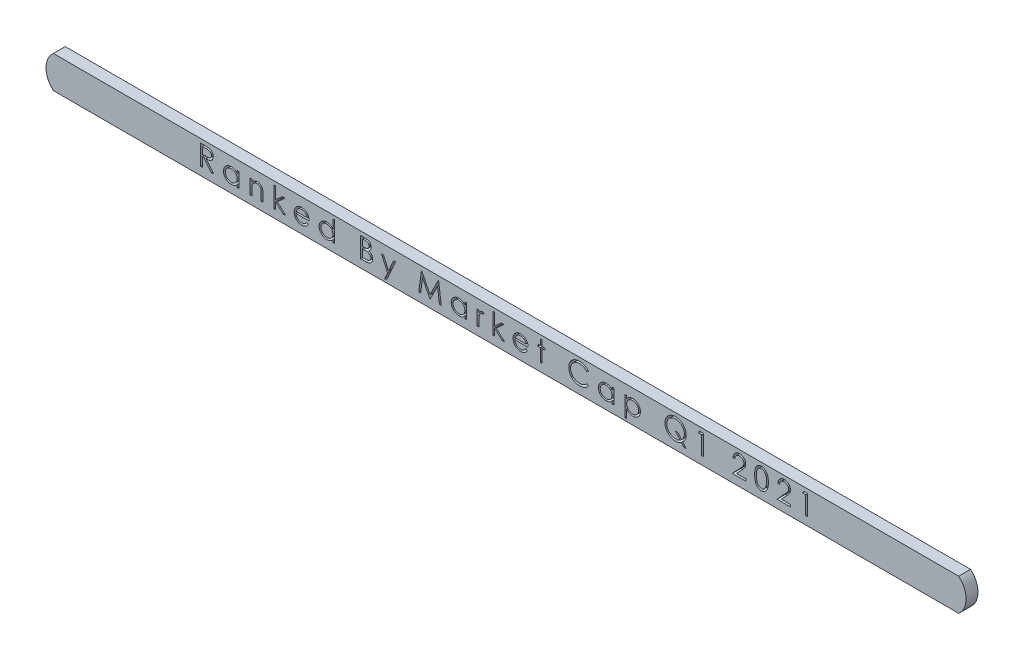
from build123d import *

# Parameters (mm, degrees)
BOSS_EXTRUDE1_DEPTH = 1.4
CUT_EXTRUDE1_DEPTH  = 1


with BuildPart() as part:
    # Sketch1 → Boss-Extrude1 (new body)
    with BuildSketch(Plane.XY):
        with BuildLine():
            Line((-52.495327103, -0.707009346), (54.304672897, -0.707009346))
            ThreePointArc((54.304672897, -0.707009346), (55.179865216, -2.607009346), (54.304672897, -4.507009346))
            Line((54.304672897, -4.507009346), (-52.495327103, -4.507009346))
            ThreePointArc((-52.495327103, -4.507009346), (-53.370519422, -2.607009346), (-52.495327103, -0.707009346))
        make_face()
    extrude(amount=BOSS_EXTRUDE1_DEPTH)

    # Sketch2 → Cut-Extrude1 (cut)
    # profile 1 of 23: a face of its own
    with BuildSketch(Plane.XY.offset(1.4)):
        Polygon((36.012178156, -1.175759346), (36.452461359, -1.175759346), (36.452461359, -3.557009346), (36.238759436, -3.557009346), (36.238759436, -1.419990115), (35.872413282, -1.419990115), align=None)
    # profile 2 of 23: a face of its own
    with BuildSketch(Plane.XY.offset(1.4)):
        with BuildLine():
            Line((33.173663282, -1.908451653), (32.959961359, -1.908451653))
            add(Edge.make_bspline(
                [(32.959961359, -1.908451653), (32.961354154, -1.880100567), (32.964089567, -1.824419789), (32.976899528, -1.743236917), (32.995228946, -1.66563892), (33.021144739, -1.592248853), (33.053329903, -1.522417808), (33.091926582, -1.456423154), (33.137642398, -1.394516649), (33.189490194, -1.337272186), (33.245802429, -1.284757071), (33.306562363, -1.2394077), (33.370410497, -1.20109157), (33.437153124, -1.169059511), (33.507543257, -1.145015794), (33.58094213, -1.127175715), (33.657672221, -1.116442165), (33.709950879, -1.115288425), (33.736538883, -1.114701653)],
                knots=[0, 0, 0, 0, 1.10065271, 2.161652631, 3.183658789, 4.190468796, 5.17591951, 6.163126047, 7.15150782, 8.156236427, 9.156009102, 10.134482811, 11.092018607, 12.041330605, 13.001268258, 13.972401359, 14.968799086, 16, 16, 16, 16], degree=3))
            add(Edge.make_bspline(
                [(33.736538883, -1.114701653), (33.76264968, -1.115312925), (33.813956463, -1.116514051), (33.88883794, -1.126828965), (33.960123921, -1.142984448), (34.027675062, -1.16565083), (34.090952403, -1.196120235), (34.150431295, -1.232721775), (34.206819847, -1.275053481), (34.257579105, -1.324892237), (34.304189066, -1.378097787), (34.344399708, -1.434899379), (34.378834735, -1.493566089), (34.407537424, -1.554545277), (34.42866669, -1.618411101), (34.444708292, -1.684233752), (34.453775694, -1.752694561), (34.455167312, -1.799031342), (34.45587482, -1.822589274)],
                knots=[0, 0, 0, 0, 1.111607364, 2.184268762, 3.212621178, 4.221274766, 5.211760367, 6.196651075, 7.1921475, 8.207485113, 9.220403448, 10.201281604, 11.166441695, 12.114753415, 13.065576456, 14.026450734, 14.996634279, 16, 16, 16, 16], degree=3))
            add(Edge.make_bspline(
                [(34.45587482, -1.822589274), (34.454722797, -1.855755211), (34.452438966, -1.921505071), (34.432902935, -2.018125897), (34.402391291, -2.111738563), (34.365653803, -2.187079477), (34.328593087, -2.247790122), (34.295196051, -2.29777508), (34.256099456, -2.35159505), (34.210734264, -2.40906981), (34.160038899, -2.470649551), (34.103554177, -2.536297073), (34.040877308, -2.605334116), (33.996886435, -2.652486677), (33.974091467, -2.676919953)],
                knots=[0, 0, 0, 0, 1.184426356, 2.348067706, 3.509069118, 4.696110526, 5.333549288, 6.050745305, 6.844228056, 7.710549037, 8.667450064, 9.695053472, 10.805634456, 12, 12, 12, 12], degree=3))
            Line((33.974091467, -2.676919953), (33.378301954, -3.312778577))
            Line((33.378301954, -3.312778577), (34.486403666, -3.312778577))
            Line((34.486403666, -3.312778577), (34.486403666, -3.557009346))
            Line((34.486403666, -3.557009346), (32.86837482, -3.557009346))
            Line((32.86837482, -3.557009346), (33.791872416, -2.571500031))
            add(Edge.make_bspline(
                [(33.791872416, -2.571500031), (33.814356782, -2.548028862), (33.857544648, -2.502945549), (33.918628865, -2.437125785), (33.973492177, -2.376064044), (34.022489724, -2.319875696), (34.064558591, -2.267738861), (34.101891306, -2.221342108), (34.13180361, -2.178646669), (34.16426712, -2.129157073), (34.195709133, -2.068732978), (34.222727718, -1.994891308), (34.239202463, -1.918876873), (34.241178788, -1.867508523), (34.242172897, -1.841669803)],
                knots=[0, 0, 0, 0, 1.329631726, 2.553950428, 3.673215718, 4.687767853, 5.603093632, 6.413772471, 7.123043292, 7.734684054, 8.834405432, 9.900288307, 10.943827018, 12, 12, 12, 12], degree=3))
            add(Edge.make_bspline(
                [(34.242172897, -1.841669803), (34.241740365, -1.825421923), (34.240887928, -1.793400471), (34.233364745, -1.74645191), (34.221995633, -1.701164064), (34.205704305, -1.657397628), (34.184200434, -1.61559264), (34.158024795, -1.575698211), (34.127823698, -1.537129469), (34.092886495, -1.500966243), (34.054506515, -1.467845637), (34.013961142, -1.438505857), (33.971064553, -1.413986391), (33.925997613, -1.393886262), (33.878885963, -1.378118726), (33.829638484, -1.367193156), (33.778391252, -1.360333466), (33.743398106, -1.359405342), (33.725567579, -1.358932423)],
                knots=[0, 0, 0, 0, 0.991446411, 1.95395049, 2.89581595, 3.838931463, 4.798493298, 5.75982156, 6.748411868, 7.785213223, 8.824556874, 9.840280684, 10.836137867, 11.835679398, 12.848801643, 13.863922112, 14.911575587, 16, 16, 16, 16], degree=3))
            add(Edge.make_bspline(
                [(33.725567579, -1.358932423), (33.706945637, -1.3594189), (33.670375219, -1.360374261), (33.616682091, -1.367057181), (33.565460874, -1.378586404), (33.516582723, -1.39435482), (33.469964933, -1.414397154), (33.425834217, -1.439360645), (33.384289644, -1.469149057), (33.345253117, -1.502922364), (33.309286731, -1.540524072), (33.277686267, -1.58244085), (33.250074643, -1.627907359), (33.225983719, -1.67680092), (33.206419579, -1.729565188), (33.19146999, -1.786012858), (33.179640724, -1.845898834), (33.175688856, -1.887254401), (33.173663282, -1.908451653)],
                knots=[0, 0, 0, 0, 1.031018746, 2.02475058, 2.990194455, 3.934040569, 4.864654155, 5.795059489, 6.735614925, 7.690564532, 8.649604399, 9.611025574, 10.590972636, 11.591080095, 12.624614302, 13.701020113, 14.821632451, 16, 16, 16, 16], degree=3))
        make_face()
    # profile 3 of 23: a face of its own
    with BuildSketch(Plane.XY.offset(1.4)):
        with BuildLine():
            add(Edge.make_bspline(
                [(30.230682513, -2.367338372), (30.230905682, -2.329172114), (30.231339192, -2.255033607), (30.23616185, -2.147003341), (30.244173288, -2.045657145), (30.255152465, -1.950990166), (30.268513305, -1.862977965), (30.286349199, -1.781855747), (30.306632552, -1.70724805), (30.330140555, -1.638911585), (30.356666176, -1.575925683), (30.385536628, -1.51712568), (30.417897676, -1.462600544), (30.451899826, -1.411480012), (30.488919467, -1.364600891), (30.527903109, -1.321301151), (30.570372278, -1.282581515), (30.614883289, -1.247307513), (30.661839134, -1.21638564), (30.709901376, -1.189149081), (30.759400832, -1.165880957), (30.810472646, -1.147585857), (30.862657779, -1.132474548), (30.916138658, -1.122140639), (30.971003586, -1.115638528), (31.008036402, -1.115016908), (31.026817579, -1.114701653)],
                knots=[0, 0, 0, 0, 1.646270934, 3.197905019, 4.663502075, 6.030701355, 7.308322542, 8.50163776, 9.611534131, 10.641858119, 11.616356847, 12.558055219, 13.465016945, 14.349605745, 15.204443733, 16.039544428, 16.859896111, 17.680448484, 18.487036065, 19.28249412, 20.06191084, 20.843045899, 21.620316918, 22.403196591, 23.190181807, 24, 24, 24, 24], degree=3))
            add(Edge.make_bspline(
                [(31.026817579, -1.114701653), (31.045755645, -1.115033542), (31.083417501, -1.115693564), (31.139098185, -1.122037175), (31.193492522, -1.132563064), (31.246368613, -1.147477156), (31.298160791, -1.165979928), (31.348463954, -1.189171342), (31.397590558, -1.216167143), (31.444759914, -1.247888031), (31.490489858, -1.283254544), (31.533657133, -1.323234145), (31.574265668, -1.367423151), (31.612825117, -1.415348776), (31.648241514, -1.467930235), (31.681969153, -1.524252996), (31.712157985, -1.585302031), (31.741232826, -1.650058742), (31.766329151, -1.72031491), (31.788962079, -1.795674506), (31.807249377, -1.877027658), (31.822482078, -1.963947532), (31.834282802, -2.056753337), (31.84287751, -2.155246134), (31.847417591, -2.259490721), (31.848272597, -2.330763472), (31.848711359, -2.367338372)],
                knots=[0, 0, 0, 0, 0.810914788, 1.612654377, 2.396697861, 3.181598691, 3.963628158, 4.749916497, 5.551656086, 6.361998678, 7.18212741, 8.025565596, 8.878627764, 9.750805457, 10.657531673, 11.591944965, 12.560506719, 13.57287815, 14.630710178, 15.753379473, 16.941251878, 18.199788006, 19.531962791, 20.947069417, 22.433333509, 24, 24, 24, 24], degree=3))
            add(Edge.make_bspline(
                [(31.848711359, -2.367338372), (31.848268049, -2.403753745), (31.847404277, -2.474707615), (31.842928407, -2.578483153), (31.834111909, -2.676453251), (31.823083328, -2.768852869), (31.807808655, -2.855297427), (31.789027283, -2.936086061), (31.768174117, -3.011567653), (31.742432944, -3.081123837), (31.714258872, -3.14572492), (31.683605247, -3.206050248), (31.650764526, -3.262633029), (31.614985398, -3.315020357), (31.576849058, -3.363583336), (31.535539277, -3.407464754), (31.492220539, -3.447721943), (31.446356021, -3.483543854), (31.398451019, -3.51489798), (31.349493147, -3.542938118), (31.298613738, -3.565548219), (31.246965818, -3.584962238), (31.193810626, -3.599794331), (31.139214421, -3.610049937), (31.083454911, -3.617242569), (31.04576206, -3.617791264), (31.026817579, -3.618067038)],
                knots=[0, 0, 0, 0, 1.561518951, 3.042555995, 4.452378317, 5.7783523, 7.031515105, 8.214008947, 9.334062868, 10.386615937, 11.391082383, 12.354592575, 13.286541444, 14.194233754, 15.072674879, 15.931287219, 16.775624067, 17.606195743, 18.42308326, 19.229000347, 20.022332153, 20.807536673, 21.593273796, 22.3848459, 23.188221202, 24, 24, 24, 24], degree=3))
            add(Edge.make_bspline(
                [(31.026817579, -3.618067038), (31.008036923, -3.61774975), (30.971005134, -3.617124119), (30.916132681, -3.610651384), (30.862872661, -3.600244979), (30.810962259, -3.58567404), (30.760135148, -3.567838589), (30.711083924, -3.544601886), (30.663263196, -3.517840671), (30.616800549, -3.487363786), (30.57256906, -3.452446713), (30.530319831, -3.413826723), (30.491114237, -3.370540081), (30.454623897, -3.32327028), (30.419943312, -3.272452199), (30.388041792, -3.217392002), (30.358534122, -3.158308012), (30.33156239, -3.094818505), (30.307648746, -3.025997027), (30.286525216, -2.951056247), (30.269846833, -2.869334716), (30.25557093, -2.781488793), (30.244056305, -2.687140994), (30.236195237, -2.586240098), (30.231336593, -2.478848983), (30.230904518, -2.405186868), (30.230682513, -2.367338372)],
                knots=[0, 0, 0, 0, 0.810891512, 1.598919785, 2.382837074, 3.152667961, 3.926044502, 4.706494248, 5.493654104, 6.291793342, 7.103789334, 7.925228297, 8.761435821, 9.622817696, 10.50288917, 11.416980706, 12.369136599, 13.353924996, 14.394355917, 15.514179734, 16.714354668, 17.994756427, 19.357759367, 20.818452758, 22.365282078, 24, 24, 24, 24], degree=3))
        make_face()
        with BuildLine():
            add(Edge.make_bspline(
                [(30.444384436, -2.366384346), (30.444465702, -2.398190157), (30.444623425, -2.459918991), (30.448743804, -2.549619495), (30.454356909, -2.633283237), (30.461596791, -2.711016447), (30.47234844, -2.782556009), (30.48439538, -2.848393954), (30.499055776, -2.90818186), (30.516401494, -2.962329995), (30.536158451, -3.011757308), (30.557729762, -3.057750277), (30.580903218, -3.10085222), (30.606837854, -3.140675978), (30.635082924, -3.177351422), (30.665000445, -3.211527688), (30.697706971, -3.242005635), (30.742953267, -3.278559084), (30.802686226, -3.316331924), (30.877947643, -3.349224531), (30.955282785, -3.369895452), (31.007773189, -3.372524186), (31.033972777, -3.373836269)],
                knots=[0, 0, 0, 0, 1.459021318, 2.831673884, 4.118529203, 5.306027144, 6.411944654, 7.436330062, 8.375795394, 9.233974572, 10.042671642, 10.816086306, 11.563610507, 12.285937304, 12.993564865, 13.685989202, 14.367179055, 15.041617293, 16.353048772, 17.594441528, 18.799311195, 20, 20, 20, 20], degree=3))
            add(Edge.make_bspline(
                [(31.033972777, -3.373836269), (31.060341836, -3.372749207), (31.113025511, -3.370577328), (31.189996897, -3.349623188), (31.264720705, -3.318007304), (31.323280365, -3.280623377), (31.367831881, -3.245021424), (31.39975219, -3.214667529), (31.429049763, -3.180679698), (31.45683696, -3.144008927), (31.48232251, -3.103954612), (31.505497609, -3.06070936), (31.526645386, -3.01415308), (31.538693862, -2.981652597), (31.544853937, -2.965035938)],
                knots=[0, 0, 0, 0, 1.353760809, 2.704726607, 4.075137775, 5.516104923, 6.260822281, 7.007110065, 7.778089737, 8.566572457, 9.372053459, 10.217411131, 11.088608312, 12, 12, 12, 12], degree=3))
            add(Edge.make_bspline(
                [(31.544853937, -2.965035938), (31.552032907, -2.943788562), (31.566609297, -2.900647276), (31.585395164, -2.833724863), (31.600189802, -2.763510125), (31.613499878, -2.69042268), (31.622584725, -2.613923526), (31.629897076, -2.534249361), (31.634204204, -2.451340113), (31.634738115, -2.395009949), (31.635009436, -2.366384346)],
                knots=[0, 0, 0, 0, 0.884706709, 1.796334032, 2.740027952, 3.714592787, 4.726048262, 5.777819803, 6.87074269, 8, 8, 8, 8], degree=3))
            add(Edge.make_bspline(
                [(31.635009436, -2.366384346), (31.63463511, -2.337763372), (31.63390285, -2.28177463), (31.63110387, -2.199779225), (31.623876045, -2.121900266), (31.61584843, -2.047802248), (31.604012106, -1.977895346), (31.591250098, -1.911594334), (31.574104274, -1.849720598), (31.555789212, -1.791305418), (31.53482714, -1.737012473), (31.511752328, -1.686588629), (31.487108595, -1.63979045), (31.460341821, -1.596746335), (31.431769758, -1.557263479), (31.400638283, -1.522133514), (31.368182272, -1.490267648), (31.322722722, -1.453894008), (31.263208964, -1.416806586), (31.189155051, -1.382675953), (31.112090559, -1.363076026), (31.059993262, -1.360312628), (31.033972777, -1.358932423)],
                knots=[0, 0, 0, 0, 1.31362396, 2.569729283, 3.763502607, 4.902122613, 5.988968491, 7.01645872, 7.998833611, 8.933434873, 9.825090667, 10.667526885, 11.477055099, 12.250526234, 12.991942729, 13.710640831, 14.402115721, 15.076753259, 16.378508321, 17.609869233, 18.806226677, 20, 20, 20, 20], degree=3))
            add(Edge.make_bspline(
                [(31.033972777, -1.358932423), (31.007635749, -1.360314532), (30.954913714, -1.363081268), (30.87704823, -1.382602928), (30.802410091, -1.416629607), (30.74305371, -1.454016846), (30.697562455, -1.48962559), (30.665529409, -1.520504588), (30.635494245, -1.554281772), (30.607825685, -1.591294503), (30.581911369, -1.631071834), (30.558111787, -1.67392669), (30.536668747, -1.720076243), (30.516880875, -1.769481353), (30.499482246, -1.823624817), (30.485130817, -1.883339079), (30.471872661, -1.948967616), (30.462486952, -2.020894639), (30.454143218, -2.098647318), (30.448781086, -2.182519922), (30.444609642, -2.272370866), (30.444461008, -2.334418865), (30.444384436, -2.366384346)],
                knots=[0, 0, 0, 0, 1.207732386, 2.417664972, 3.655092373, 4.956220595, 5.625982001, 6.301752483, 6.994047911, 7.697131622, 8.419323945, 9.170223765, 9.943494443, 10.752040957, 11.610060368, 12.549350801, 13.567764191, 14.679664412, 15.874934091, 17.154273443, 18.533957287, 20, 20, 20, 20], degree=3))
        make_face(mode=Mode.SUBTRACT)
    # profile 4 of 23: a face of its own
    with BuildSketch(Plane.XY.offset(1.4)):
        with BuildLine():
            Line((27.898278666, -1.908451653), (27.684576743, -1.908451653))
            add(Edge.make_bspline(
                [(27.684576743, -1.908451653), (27.685969539, -1.880100567), (27.688704951, -1.824419789), (27.701514912, -1.743236917), (27.71984433, -1.66563892), (27.745760123, -1.592248853), (27.777945287, -1.522417808), (27.816541967, -1.456423154), (27.862257783, -1.394516649), (27.914105579, -1.337272186), (27.970417813, -1.284757071), (28.031177747, -1.2394077), (28.095025882, -1.20109157), (28.161768509, -1.169059511), (28.232158642, -1.145015794), (28.305557515, -1.127175715), (28.382287606, -1.116442165), (28.434566264, -1.115288425), (28.461154267, -1.114701653)],
                knots=[0, 0, 0, 0, 1.10065271, 2.161652631, 3.183658789, 4.190468796, 5.17591951, 6.163126047, 7.15150782, 8.156236427, 9.156009102, 10.134482811, 11.092018607, 12.041330605, 13.001268258, 13.972401359, 14.968799086, 16, 16, 16, 16], degree=3))
            add(Edge.make_bspline(
                [(28.461154267, -1.114701653), (28.487265064, -1.115312925), (28.538571847, -1.116514051), (28.613453325, -1.126828965), (28.684739306, -1.142984448), (28.752290447, -1.16565083), (28.815567787, -1.196120235), (28.87504668, -1.232721775), (28.931435232, -1.275053481), (28.98219449, -1.324892237), (29.028804451, -1.378097787), (29.069015092, -1.434899379), (29.10345012, -1.493566089), (29.132152809, -1.554545277), (29.153282075, -1.618411101), (29.169323677, -1.684233752), (29.178391078, -1.752694561), (29.179782697, -1.799031342), (29.180490205, -1.822589274)],
                knots=[0, 0, 0, 0, 1.111607364, 2.184268762, 3.212621178, 4.221274766, 5.211760367, 6.196651075, 7.1921475, 8.207485113, 9.220403448, 10.201281604, 11.166441695, 12.114753415, 13.065576456, 14.026450734, 14.996634279, 16, 16, 16, 16], degree=3))
            add(Edge.make_bspline(
                [(29.180490205, -1.822589274), (29.179338181, -1.855755211), (29.177054351, -1.921505071), (29.15751832, -2.018125897), (29.127006675, -2.111738563), (29.090269188, -2.187079477), (29.053208472, -2.247790122), (29.019811435, -2.29777508), (28.980714841, -2.35159505), (28.935349648, -2.40906981), (28.884654283, -2.470649551), (28.828169562, -2.536297073), (28.765492693, -2.605334116), (28.72150182, -2.652486677), (28.698706852, -2.676919953)],
                knots=[0, 0, 0, 0, 1.184426356, 2.348067706, 3.509069118, 4.696110526, 5.333549288, 6.050745305, 6.844228056, 7.710549037, 8.667450064, 9.695053472, 10.805634456, 12, 12, 12, 12], degree=3))
            Line((28.698706852, -2.676919953), (28.102917338, -3.312778577))
            Line((28.102917338, -3.312778577), (29.211019051, -3.312778577))
            Line((29.211019051, -3.312778577), (29.211019051, -3.557009346))
            Line((29.211019051, -3.557009346), (27.592990205, -3.557009346))
            Line((27.592990205, -3.557009346), (28.516487801, -2.571500031))
            add(Edge.make_bspline(
                [(28.516487801, -2.571500031), (28.538972167, -2.548028862), (28.582160032, -2.502945549), (28.64324425, -2.437125785), (28.698107561, -2.376064044), (28.747105109, -2.319875696), (28.789173976, -2.267738861), (28.826506691, -2.221342108), (28.856418995, -2.178646669), (28.888882505, -2.129157073), (28.920324517, -2.068732978), (28.947343102, -1.994891308), (28.963817848, -1.918876873), (28.965794173, -1.867508523), (28.966788282, -1.841669803)],
                knots=[0, 0, 0, 0, 1.329631726, 2.553950428, 3.673215718, 4.687767853, 5.603093632, 6.413772471, 7.123043292, 7.734684054, 8.834405432, 9.900288307, 10.943827018, 12, 12, 12, 12], degree=3))
            add(Edge.make_bspline(
                [(28.966788282, -1.841669803), (28.96635575, -1.825421923), (28.965503313, -1.793400471), (28.957980129, -1.74645191), (28.946611017, -1.701164064), (28.93031969, -1.657397628), (28.908815818, -1.61559264), (28.88264018, -1.575698211), (28.852439083, -1.537129469), (28.81750188, -1.500966243), (28.7791219, -1.467845637), (28.738576526, -1.438505857), (28.695679937, -1.413986391), (28.650612997, -1.393886262), (28.603501347, -1.378118726), (28.554253869, -1.367193156), (28.503006637, -1.360333466), (28.46801349, -1.359405342), (28.450182963, -1.358932423)],
                knots=[0, 0, 0, 0, 0.991446411, 1.95395049, 2.89581595, 3.838931463, 4.798493298, 5.75982156, 6.748411868, 7.785213223, 8.824556874, 9.840280684, 10.836137867, 11.835679398, 12.848801643, 13.863922112, 14.911575587, 16, 16, 16, 16], degree=3))
            add(Edge.make_bspline(
                [(28.450182963, -1.358932423), (28.431561022, -1.3594189), (28.394990603, -1.360374261), (28.341297475, -1.367057181), (28.290076259, -1.378586404), (28.241198107, -1.39435482), (28.194580318, -1.414397154), (28.150449602, -1.439360645), (28.108905029, -1.469149057), (28.069868501, -1.502922364), (28.033902116, -1.540524072), (28.002301652, -1.58244085), (27.974690028, -1.627907359), (27.950599103, -1.67680092), (27.931034964, -1.729565188), (27.916085374, -1.786012858), (27.904256109, -1.845898834), (27.90030424, -1.887254401), (27.898278666, -1.908451653)],
                knots=[0, 0, 0, 0, 1.031018746, 2.02475058, 2.990194455, 3.934040569, 4.864654155, 5.795059489, 6.735614925, 7.690564532, 8.649604399, 9.611025574, 10.590972636, 11.591080095, 12.624614302, 13.701020113, 14.821632451, 16, 16, 16, 16], degree=3))
        make_face()
    # profile 5 of 23: a face of its own
    with BuildSketch(Plane.XY.offset(1.4)):
        Polygon((23.739582002, -1.175759346), (24.179865205, -1.175759346), (24.179865205, -3.557009346), (23.966163282, -3.557009346), (23.966163282, -1.419990115), (23.599817128, -1.419990115), align=None)
    # profile 6 of 23: a face of its own
    with BuildSketch(Plane.XY.offset(1.4)):
        with BuildLine():
            Line((21.756351833, -3.291789995), (22.122220974, -3.740182423))
            Line((22.122220974, -3.740182423), (21.855570583, -3.740182423))
            Line((21.855570583, -3.740182423), (21.591305259, -3.416767459))
            add(Edge.make_bspline(
                [(21.591305259, -3.416767459), (21.564800523, -3.432874054), (21.512279289, -3.464790548), (21.430386987, -3.505929136), (21.34686614, -3.540161808), (21.261901546, -3.568444237), (21.17561696, -3.591082662), (21.087574842, -3.606794686), (20.998094512, -3.615918463), (20.937976521, -3.617348116), (20.907745313, -3.618067038)],
                knots=[0, 0, 0, 0, 1.030216282, 2.041455142, 3.041201647, 4.026904037, 5.014869161, 6.002481075, 6.995518502, 8, 8, 8, 8], degree=3))
            add(Edge.make_bspline(
                [(20.907745313, -3.618067038), (20.864433545, -3.617023815), (20.77920888, -3.614971062), (20.654043497, -3.597050144), (20.53390357, -3.569372863), (20.419028566, -3.529326589), (20.309293346, -3.47817565), (20.204748893, -3.415113839), (20.105342071, -3.341014636), (20.012540275, -3.256362301), (19.927682446, -3.164272351), (19.853225018, -3.065878395), (19.789916088, -2.96281316), (19.738727046, -2.854562693), (19.6981017, -2.74206939), (19.670416629, -2.62439768), (19.652496404, -2.502248045), (19.65043195, -2.41907903), (19.649384436, -2.376878637)],
                knots=[0, 0, 0, 0, 1.055750571, 2.07740284, 3.077223765, 4.05828044, 5.038417088, 6.02463293, 7.030503776, 8.057169806, 9.083586829, 10.080154041, 11.061747002, 12.027853603, 12.995569715, 13.972756451, 14.971366004, 16, 16, 16, 16], degree=3))
            add(Edge.make_bspline(
                [(19.649384436, -2.376878637), (19.64975713, -2.348554495), (19.650499901, -2.292105214), (19.659092234, -2.208498049), (19.671858313, -2.126267274), (19.689915436, -2.045754608), (19.713553716, -1.96663004), (19.741893574, -1.889049592), (19.776231083, -1.813213169), (19.815048805, -1.739275985), (19.858341698, -1.667878857), (19.905501631, -1.600037957), (19.956644619, -1.536421861), (20.011734457, -1.477059675), (20.070551134, -1.42182018), (20.132588874, -1.369793747), (20.199170445, -1.322915814), (20.268538553, -1.279321216), (20.341082208, -1.240985804), (20.415382457, -1.20671517), (20.491995105, -1.17890887), (20.569926099, -1.155214533), (20.649648236, -1.137125259), (20.731099384, -1.124452764), (20.814222242, -1.115777553), (20.870356904, -1.115062476), (20.898682062, -1.114701653)],
                knots=[0, 0, 0, 0, 1.030721839, 2.054201982, 3.056261636, 4.058906239, 5.055198403, 6.060579377, 7.06322398, 8.083343201, 9.098870418, 10.10084648, 11.0888991, 12.067804703, 13.046436456, 14.024708667, 15.012489976, 16.008294399, 17.005242112, 17.997338632, 18.984424362, 19.969624474, 20.960977749, 21.957320355, 22.969278161, 24, 24, 24, 24], degree=3))
            add(Edge.make_bspline(
                [(20.898682062, -1.114701653), (20.941993991, -1.115739639), (21.027061392, -1.117778309), (21.1519167, -1.13570193), (21.271702699, -1.163490275), (21.386334118, -1.203332463), (21.495708752, -1.254612219), (21.599780652, -1.317661319), (21.698711169, -1.391765431), (21.791028045, -1.476423434), (21.875686018, -1.568740307), (21.949790247, -1.66767081), (22.012838921, -1.771742765), (22.06412025, -1.881117192), (22.103956517, -1.995749393), (22.131803144, -2.115686032), (22.149641183, -2.240713168), (22.151702331, -2.325935728), (22.15274982, -2.369246425)],
                knots=[0, 0, 0, 0, 1.050672203, 2.063587442, 3.054842799, 4.031180399, 5.003107577, 5.981273811, 6.979214548, 7.998088659, 9.016962771, 10.014903508, 10.993069742, 11.96499692, 12.941334519, 13.932589877, 14.949327797, 16, 16, 16, 16], degree=3))
            add(Edge.make_bspline(
                [(22.15274982, -2.369246425), (22.151605039, -2.41431149), (22.149353892, -2.50292939), (22.13019624, -2.632878097), (22.0993941, -2.757009725), (22.055712945, -2.875242942), (21.999243084, -2.987556256), (21.931075471, -3.095072813), (21.850389362, -3.197784989), (21.788027789, -3.260124994), (21.756351833, -3.291789995)],
                knots=[0, 0, 0, 0, 1.045660934, 2.056233022, 3.041853582, 4.009978652, 4.97562384, 5.954545411, 6.961031197, 8, 8, 8, 8], degree=3))
        make_face()
        with BuildLine():
            add(Edge.make_bspline(
                [(21.612770854, -3.115772116), (21.638752796, -3.089385843), (21.689860427, -3.037482875), (21.756171574, -2.952364753), (21.813205813, -2.86388619), (21.85886793, -2.77087021), (21.89519837, -2.674482168), (21.920298713, -2.573958322), (21.936015019, -2.469756304), (21.938029505, -2.398877136), (21.939047897, -2.363045253)],
                knots=[0, 0, 0, 0, 1.052210109, 2.069743939, 3.061837814, 4.040478349, 5.010453814, 5.985306305, 6.981502329, 8, 8, 8, 8], degree=3))
            add(Edge.make_bspline(
                [(21.939047897, -2.363045253), (21.938781806, -2.339969966), (21.938255792, -2.29435419), (21.931023103, -2.226850843), (21.920790998, -2.160838396), (21.905978048, -2.096434794), (21.886902608, -2.033770522), (21.863342763, -1.972930648), (21.83575754, -1.913718897), (21.803599198, -1.85650309), (21.768147347, -1.801366154), (21.728685087, -1.748982389), (21.685767873, -1.6996219), (21.639864555, -1.652471249), (21.590090118, -1.608502384), (21.536623072, -1.567734153), (21.480122251, -1.529179977), (21.420308066, -1.494379856), (21.358669567, -1.462386576), (21.295567423, -1.434682374), (21.231531484, -1.411217909), (21.166660914, -1.39219124), (21.101039654, -1.377214829), (21.034552658, -1.366994174), (20.967371861, -1.359768933), (20.922233927, -1.359211497), (20.899636088, -1.358932423)],
                knots=[0, 0, 0, 0, 1.032958288, 2.041976502, 3.037103433, 4.023477888, 4.998866292, 5.968231228, 6.943073582, 7.921783703, 8.90545537, 9.876780072, 10.85618943, 11.833110341, 12.821898168, 13.827467856, 14.842673888, 15.88323808, 16.924703457, 17.951432745, 18.967462636, 19.976958182, 20.977218729, 21.979378626, 22.98839684, 24, 24, 24, 24], degree=3))
            add(Edge.make_bspline(
                [(20.899636088, -1.358932423), (20.876879665, -1.359213444), (20.831425271, -1.359774766), (20.763920136, -1.366954213), (20.697280552, -1.37722608), (20.631799613, -1.392128057), (20.567245428, -1.411191727), (20.503818368, -1.434798049), (20.440966839, -1.461817968), (20.379995067, -1.49379082), (20.321009732, -1.528890188), (20.264910947, -1.56706101), (20.212467504, -1.608684117), (20.163181928, -1.653089381), (20.117177317, -1.700619421), (20.074236461, -1.750958072), (20.035113476, -1.804689413), (19.999269463, -1.860852107), (19.967588823, -1.919507174), (19.939016906, -1.979596338), (19.915810162, -2.041782071), (19.896757918, -2.105566643), (19.881189351, -2.170791479), (19.871154805, -2.237835208), (19.863867863, -2.306279301), (19.863348866, -2.352530765), (19.863086359, -2.37592461)],
                knots=[0, 0, 0, 0, 1.013205451, 2.023808328, 3.020541854, 4.015386314, 5.012622987, 6.016502547, 7.02834558, 8.057881235, 9.080621846, 10.084476421, 11.077781791, 12.060654405, 13.037357686, 14.022218736, 15.005346502, 15.995617173, 16.98763393, 17.973029642, 18.956998942, 19.940662314, 20.93709383, 21.940823471, 22.958474994, 24, 24, 24, 24], degree=3))
            add(Edge.make_bspline(
                [(19.863086359, -2.37592461), (19.863980046, -2.410318645), (19.865738206, -2.47798235), (19.880312915, -2.577324348), (19.904749242, -2.672429085), (19.93893668, -2.76343262), (19.981854318, -2.85085948), (20.035225646, -2.933853175), (20.098822968, -3.012097592), (20.170240368, -3.086130165), (20.248800574, -3.153200711), (20.332082013, -3.212230114), (20.419373645, -3.262311333), (20.510949583, -3.30273272), (20.606126941, -3.335192461), (20.705657047, -3.357168354), (20.808889268, -3.371734567), (20.879232352, -3.373129138), (20.914900511, -3.373836269)],
                knots=[0, 0, 0, 0, 1.022526523, 2.011626, 2.97850031, 3.937665323, 4.897797383, 5.869804095, 6.865337375, 7.89202157, 8.925035373, 9.93268082, 10.923937058, 11.912550332, 12.905497077, 13.90928476, 14.939882052, 16, 16, 16, 16], degree=3))
            add(Edge.make_bspline(
                [(20.914900511, -3.373836269), (20.93940589, -3.373569317), (20.987875798, -3.373041304), (21.05935004, -3.365842705), (21.129075235, -3.355710528), (21.196405708, -3.340300479), (21.26192532, -3.321142399), (21.325244077, -3.297838324), (21.386697862, -3.270211148), (21.425772861, -3.2483548), (21.445339213, -3.237410488)],
                knots=[0, 0, 0, 0, 1.060694673, 2.097979151, 3.107774411, 4.11000626, 5.086069662, 6.061987343, 7.029562652, 8, 8, 8, 8], degree=3))
            Line((21.445339213, -3.237410488), (20.909176353, -2.580086269))
            Line((20.909176353, -2.580086269), (21.175826743, -2.580086269))
            Line((21.175826743, -2.580086269), (21.612770854, -3.115772116))
        make_face(mode=Mode.SUBTRACT)
    # profile 7 of 23: a face of its own
    with BuildSketch(Plane.XY.offset(1.4)):
        with BuildLine():
            Line((14.923519051, -1.816865115), (15.137220974, -1.816865115))
            Line((15.137220974, -1.816865115), (15.137220974, -2.138849039))
            add(Edge.make_bspline(
                [(15.137220974, -2.138849039), (15.159915977, -2.109636045), (15.204019172, -2.052866438), (15.280032009, -1.979394583), (15.360264356, -1.917430849), (15.446780892, -1.868865233), (15.53823701, -1.832247859), (15.63425739, -1.805183626), (15.735656978, -1.789235052), (15.804982958, -1.787315314), (15.840338462, -1.786336269)],
                knots=[0, 0, 0, 0, 1.0828784, 2.104357462, 3.088488658, 4.04616522, 5.001424249, 5.969181776, 6.964304535, 8, 8, 8, 8], degree=3))
            add(Edge.make_bspline(
                [(15.840338462, -1.786336269), (15.871220964, -1.7872297), (15.93226185, -1.788995612), (16.022112011, -1.800951565), (16.108636692, -1.821442352), (16.191346386, -1.850970475), (16.27112715, -1.887475357), (16.3467979, -1.933547126), (16.419537301, -1.986891338), (16.487515994, -2.048281427), (16.550327496, -2.114703515), (16.604651415, -2.18615619), (16.651508907, -2.260289664), (16.689384591, -2.338253212), (16.719053842, -2.419432902), (16.740154899, -2.504156717), (16.752712689, -2.592110526), (16.754397561, -2.65191577), (16.75524982, -2.682167098)],
                knots=[0, 0, 0, 0, 1.041296284, 2.058176809, 3.050446431, 4.034000596, 5.01514041, 6.003636468, 7.015969324, 8.052561599, 9.08815499, 10.094063707, 11.074456064, 12.040834395, 13.011057502, 13.983766392, 14.980127149, 16, 16, 16, 16], degree=3))
            add(Edge.make_bspline(
                [(16.75524982, -2.682167098), (16.754416052, -2.713056883), (16.752771742, -2.773975997), (16.740018443, -2.863434183), (16.71963707, -2.949490771), (16.690342127, -3.032002623), (16.652486043, -3.110912929), (16.606422762, -3.186164781), (16.552071434, -3.257734068), (16.489954059, -3.324649166), (16.422562687, -3.386289056), (16.35052818, -3.440199242), (16.274968447, -3.485471142), (16.196270062, -3.523287406), (16.113759315, -3.551789052), (16.027821174, -3.572347949), (15.938502428, -3.585026061), (15.877745752, -3.586694394), (15.847016647, -3.587538192)],
                knots=[0, 0, 0, 0, 1.038740735, 2.04854663, 3.033179607, 4.009277356, 4.987731542, 5.972001279, 6.972200261, 8.005528982, 9.039189865, 10.040446548, 11.026516639, 11.997840187, 12.972163198, 13.956796175, 14.96660207, 16, 16, 16, 16], degree=3))
            add(Edge.make_bspline(
                [(15.847016647, -3.587538192), (15.812435746, -3.58665726), (15.744128327, -3.584917162), (15.644253483, -3.567282706), (15.548134768, -3.540927755), (15.456837081, -3.50235219), (15.369637195, -3.453192634), (15.287028363, -3.393246226), (15.208571786, -3.322638336), (15.161349042, -3.269072583), (15.137220974, -3.241703607)],
                knots=[0, 0, 0, 0, 1.014726462, 2.004382257, 2.969841629, 3.936926163, 4.907207904, 5.903978561, 6.929055279, 8, 8, 8, 8], degree=3))
            Line((15.137220974, -3.241703607), (15.137220974, -4.198115115))
            Line((15.137220974, -4.198115115), (14.923519051, -4.198115115))
            Line((14.923519051, -4.198115115), (14.923519051, -1.816865115))
        make_face()
        with BuildLine():
            add(Edge.make_bspline(
                [(15.838430409, -2.000038192), (15.8142236, -2.000473796), (15.766566631, -2.001331389), (15.696712854, -2.011519022), (15.629428643, -2.026308449), (15.565392101, -2.048700296), (15.50398945, -2.076185917), (15.445693616, -2.110531714), (15.390545521, -2.151116382), (15.338683916, -2.197162507), (15.291832283, -2.247899929), (15.250355719, -2.302048063), (15.215516463, -2.359538337), (15.18659991, -2.419835235), (15.164594927, -2.483411402), (15.148976839, -2.549904756), (15.139159045, -2.619388074), (15.137873894, -2.666711), (15.137220974, -2.690753336)],
                knots=[0, 0, 0, 0, 1.05670511, 2.080379991, 3.077984906, 4.06214886, 5.038337365, 6.01289324, 7.01187578, 8.025460281, 9.038092164, 10.024533457, 11.000252242, 11.969694649, 12.940728589, 13.933144304, 14.949937299, 16, 16, 16, 16], degree=3))
            add(Edge.make_bspline(
                [(15.137220974, -2.690753336), (15.138303324, -2.72231382), (15.14042374, -2.78414348), (15.1576622, -2.874484106), (15.185716906, -2.959972108), (15.225537334, -3.039887563), (15.275848095, -3.113354456), (15.336466662, -3.179138601), (15.40684454, -3.236826485), (15.485811683, -3.285418445), (15.570463169, -3.324871041), (15.658763941, -3.35311553), (15.74949969, -3.370513778), (15.810846351, -3.372722775), (15.841769502, -3.373836269)],
                knots=[0, 0, 0, 0, 1.03728447, 2.032128127, 3.01272805, 3.987917167, 4.958271349, 5.931593992, 6.91984656, 7.941419022, 8.973179163, 9.983609215, 10.983593296, 12, 12, 12, 12], degree=3))
            add(Edge.make_bspline(
                [(15.841769502, -3.373836269), (15.87206973, -3.372777377), (15.932210235, -3.370675666), (16.020764242, -3.352484149), (16.106823052, -3.324694945), (16.18858849, -3.284173175), (16.265348756, -3.234513868), (16.334664599, -3.174941774), (16.395221088, -3.105892366), (16.446835944, -3.029006224), (16.488427187, -2.946563686), (16.519676154, -2.861259563), (16.537711451, -2.773394552), (16.540267409, -2.714205037), (16.541547897, -2.684552164)],
                knots=[0, 0, 0, 0, 1.00104056, 1.986885549, 2.97790532, 3.984399681, 4.995088187, 5.994304198, 6.996462723, 8.023150851, 9.048424203, 10.043036403, 11.019596776, 12, 12, 12, 12], degree=3))
            add(Edge.make_bspline(
                [(16.541547897, -2.684552164), (16.540558159, -2.654715109), (16.538586393, -2.59527346), (16.519164212, -2.507668699), (16.489976905, -2.422019915), (16.447414407, -2.340703255), (16.396931044, -2.263976603), (16.335871033, -2.19624441), (16.267416085, -2.13693722), (16.190747208, -2.087941022), (16.108464525, -2.048966426), (16.021844913, -2.020470593), (15.931327748, -2.003343453), (15.869668576, -2.001149637), (15.838430409, -2.000038192)],
                knots=[0, 0, 0, 0, 0.983928682, 1.960191568, 2.949917689, 3.96440592, 4.982380491, 5.975291189, 6.965713506, 7.964880129, 8.970154049, 9.96478489, 10.968906225, 12, 12, 12, 12], degree=3))
        make_face(mode=Mode.SUBTRACT)
    # profile 8 of 23: a face of its own
    with BuildSketch(Plane.XY.offset(1.4)):
        with BuildLine():
            Line((13.629095974, -1.816865115), (13.629095974, -3.557009346))
            Line((13.629095974, -3.557009346), (13.415394051, -3.557009346))
            Line((13.415394051, -3.557009346), (13.415394051, -3.256014003))
            add(Edge.make_bspline(
                [(13.415394051, -3.256014003), (13.391296624, -3.283255227), (13.344270192, -3.336416818), (13.265729002, -3.405869153), (13.182474939, -3.463276547), (13.094912075, -3.509642829), (13.003119485, -3.54447171), (12.907300647, -3.569227293), (12.807416475, -3.585143456), (12.73920907, -3.586732785), (12.704644352, -3.587538192)],
                knots=[0, 0, 0, 0, 1.074387032, 2.096679803, 3.090159297, 4.057316773, 5.018401886, 5.985159533, 6.978961417, 8, 8, 8, 8], degree=3))
            add(Edge.make_bspline(
                [(12.704644352, -3.587538192), (12.673914012, -3.586703821), (12.61331242, -3.585058404), (12.524165852, -3.572293337), (12.438378089, -3.551793753), (12.355868067, -3.523286184), (12.277169697, -3.485471375), (12.201609167, -3.440199561), (12.129577925, -3.386287496), (12.062173896, -3.324655284), (12.000103552, -3.257711552), (11.945633294, -3.1863111), (11.900217359, -3.110762675), (11.862239768, -3.032022797), (11.832986898, -2.949485325), (11.812594122, -2.86343568), (11.799843925, -2.773975606), (11.798199189, -2.713056752), (11.797365205, -2.682167098)],
                knots=[0, 0, 0, 0, 1.033919861, 2.038935746, 3.024066025, 3.998881131, 4.97069526, 5.957263378, 6.95902576, 7.993208707, 9.027059324, 10.027763471, 11.009749337, 11.988697705, 12.965288445, 13.950418724, 14.960734635, 16, 16, 16, 16], degree=3))
            add(Edge.make_bspline(
                [(11.797365205, -2.682167098), (11.798217673, -2.6519159), (11.799902956, -2.592110913), (11.812457736, -2.504155227), (11.833569905, -2.419438339), (11.863197994, -2.33823299), (11.901190467, -2.26044092), (11.947405826, -2.18600711), (12.001847409, -2.114726503), (12.064611993, -2.048275186), (12.132603328, -1.986892946), (12.205339446, -1.933546792), (12.281011, -1.88747515), (12.360791727, -1.850971625), (12.443500775, -1.82143793), (12.529874459, -1.801004786), (12.619553408, -1.788964287), (12.680438903, -1.787220692), (12.711322537, -1.786336269)],
                knots=[0, 0, 0, 0, 1.020392517, 2.01726096, 2.990465484, 3.961182959, 4.928053699, 5.906110375, 6.912531644, 7.948652711, 8.985773172, 9.998621852, 10.987621588, 11.969261332, 12.953316658, 13.946091881, 14.958173133, 16, 16, 16, 16], degree=3))
            add(Edge.make_bspline(
                [(12.711322537, -1.786336269), (12.746837084, -1.787314453), (12.816479434, -1.789232627), (12.918347955, -1.805195661), (13.014716787, -1.832163975), (13.106329837, -1.86884713), (13.192858125, -1.917593855), (13.273482477, -1.979084507), (13.349046672, -2.052931279), (13.392848263, -2.109652956), (13.415394051, -2.138849039)],
                knots=[0, 0, 0, 0, 1.038897134, 2.037228247, 3.008116434, 3.962042015, 4.918381754, 5.904844433, 6.921570401, 8, 8, 8, 8], degree=3))
            Line((13.415394051, -2.138849039), (13.415394051, -1.816865115))
            Line((13.415394051, -1.816865115), (13.629095974, -1.816865115))
        make_face()
        with BuildLine():
            add(Edge.make_bspline(
                [(12.714184616, -2.000038192), (12.682946468, -2.001149649), (12.621287333, -2.003343489), (12.530769896, -2.020470456), (12.444151305, -2.048966939), (12.36186478, -2.087939089), (12.285210154, -2.136944355), (12.216702496, -2.19621801), (12.155781479, -2.264142836), (12.104544964, -2.340412308), (12.062777501, -2.42217633), (12.033408502, -2.507645814), (12.014039246, -2.5952792), (12.012060414, -2.654717028), (12.011067128, -2.684552164)],
                knots=[0, 0, 0, 0, 1.031046209, 2.035121221, 3.029706178, 4.034933723, 5.034054252, 6.02443088, 7.017295772, 8.038157696, 9.050218397, 10.03989886, 11.016116709, 12, 12, 12, 12], degree=3))
            add(Edge.make_bspline(
                [(12.011067128, -2.684552164), (12.012335921, -2.714209005), (12.014868535, -2.773406442), (12.033068561, -2.861159299), (12.063602904, -2.946648924), (12.105269378, -3.029149707), (12.157443671, -3.105747104), (12.217919701, -3.174966723), (12.287282303, -3.234490889), (12.364113339, -3.284318595), (12.446169833, -3.324570239), (12.532462205, -3.352577576), (12.621368308, -3.370659959), (12.681819628, -3.372772112), (12.712276563, -3.373836269)],
                knots=[0, 0, 0, 0, 0.979072187, 1.954306742, 2.945804271, 3.96968567, 4.997920485, 5.998718438, 6.996577872, 8.005894225, 9.015743152, 10.005417472, 10.995077863, 12, 12, 12, 12], degree=3))
            add(Edge.make_bspline(
                [(12.712276563, -3.373836269), (12.743196416, -3.372706901), (12.804692936, -3.370460699), (12.895478914, -3.35326041), (12.983581737, -3.324842709), (13.067801262, -3.285450625), (13.146257416, -3.236629995), (13.216672936, -3.179475171), (13.27621505, -3.113002112), (13.326692522, -3.039947775), (13.366272582, -2.959861577), (13.395103437, -2.874589565), (13.412149041, -2.784128771), (13.414297425, -2.722308849), (13.415394051, -2.690753336)],
                knots=[0, 0, 0, 0, 1.01762866, 2.023962475, 3.030623092, 4.058876274, 5.077231937, 6.066672613, 7.034107872, 8.005628644, 8.981990164, 9.965428785, 10.961468474, 12, 12, 12, 12], degree=3))
            add(Edge.make_bspline(
                [(13.415394051, -2.690753336), (13.414741142, -2.666710991), (13.41345601, -2.619388047), (13.403638069, -2.549904861), (13.388020521, -2.483411022), (13.366013573, -2.419836621), (13.337104324, -2.359533155), (13.302237541, -2.302067633), (13.260800083, -2.24773893), (13.213458999, -2.197295162), (13.161639459, -2.151285015), (13.106806388, -2.110215773), (13.048310133, -2.076477697), (12.987134435, -2.048554975), (12.923173152, -2.026335089), (12.85590582, -2.011511676), (12.786047437, -2.001333315), (12.738391103, -2.000474445), (12.714184616, -2.000038192)],
                knots=[0, 0, 0, 0, 1.050140795, 2.067009409, 3.05949893, 4.030605086, 5.00011959, 5.97591094, 6.962425594, 7.979863591, 8.993523472, 9.986985069, 10.967611495, 11.937549037, 12.921786183, 13.919465291, 14.943216303, 16, 16, 16, 16], degree=3))
        make_face(mode=Mode.SUBTRACT)
    # profile 9 of 23: a face of its own
    with BuildSketch(Plane.XY.offset(1.4)):
        with BuildLine():
            Line((10.625057513, -1.612703456), (10.43806833, -1.755807423))
            add(Edge.make_bspline(
                [(10.43806833, -1.755807423), (10.424729324, -1.739910218), (10.39823115, -1.708330138), (10.355600514, -1.663984769), (10.311172075, -1.622438583), (10.264962816, -1.583493661), (10.216140986, -1.548511897), (10.165889264, -1.515670307), (10.113367023, -1.486232793), (10.040737718, -1.450539226), (9.945727306, -1.413292288), (9.826124032, -1.382061697), (9.701270945, -1.362180861), (9.616091864, -1.360027639), (9.572766347, -1.358932423)],
                knots=[0, 0, 0, 0, 0.757959112, 1.505699292, 2.245454638, 2.979532153, 3.711538275, 4.438200793, 5.171680507, 5.909471876, 7.393775596, 8.890124382, 10.418191784, 12, 12, 12, 12], degree=3))
            add(Edge.make_bspline(
                [(9.572766347, -1.358932423), (9.548897173, -1.359207261), (9.501380355, -1.359754388), (9.430862376, -1.366972382), (9.361661175, -1.377117331), (9.293821767, -1.392170452), (9.227430504, -1.411201824), (9.162053352, -1.433943043), (9.098636854, -1.462079103), (9.036303732, -1.493177045), (8.976582519, -1.528302145), (8.920075424, -1.566615336), (8.866988538, -1.607687882), (8.817279868, -1.651673724), (8.770898596, -1.698374773), (8.728180801, -1.748288726), (8.689274298, -1.801256009), (8.653407894, -1.856578166), (8.621286374, -1.914094057), (8.594391938, -1.97401656), (8.570575953, -2.03531953), (8.551730575, -2.098695588), (8.536814074, -2.163698791), (8.52652186, -2.230503595), (8.519385954, -2.298970438), (8.518841547, -2.345377131), (8.518567128, -2.368769412)],
                knots=[0, 0, 0, 0, 1.054917814, 2.100044995, 3.131103042, 4.146048494, 5.169673617, 6.183595914, 7.203665975, 8.234915748, 9.262203917, 10.264457458, 11.251630812, 12.227803204, 13.197192746, 14.159520551, 15.12972552, 16.100847026, 17.073214652, 18.039054194, 19.002613845, 19.979014051, 20.95965708, 21.949030935, 22.966165397, 24, 24, 24, 24], degree=3))
            add(Edge.make_bspline(
                [(8.518567128, -2.368769412), (8.519425616, -2.403965185), (8.521111142, -2.473067417), (8.536111884, -2.574284564), (8.558907312, -2.671249523), (8.593071838, -2.763356165), (8.635198907, -2.851740245), (8.688430465, -2.934906322), (8.750082074, -3.014111163), (8.82102592, -3.087482883), (8.898862734, -3.154507399), (8.982375153, -3.213528777), (9.071355177, -3.262728724), (9.164820349, -3.303669859), (9.263489901, -3.335140954), (9.367186401, -3.357296188), (9.475684312, -3.371748457), (9.549822421, -3.373132092), (9.587553757, -3.373836269)],
                knots=[0, 0, 0, 0, 1.029171465, 2.020641659, 2.987623507, 3.938342917, 4.889210282, 5.84687017, 6.821220943, 7.821438502, 8.827599549, 9.822697543, 10.807740252, 11.797342354, 12.80366471, 13.83203677, 14.896651826, 16, 16, 16, 16], degree=3))
            add(Edge.make_bspline(
                [(9.587553757, -3.373836269), (9.629125407, -3.372687296), (9.710948361, -3.370425841), (9.830941608, -3.351267495), (9.945810227, -3.320203804), (10.055560397, -3.276730396), (10.159882719, -3.220216334), (10.258940447, -3.151705814), (10.352817194, -3.070547145), (10.409267299, -3.008578088), (10.43806833, -2.976961269)],
                knots=[0, 0, 0, 0, 1.028121516, 2.023589091, 2.998037872, 3.967518031, 4.937445131, 5.927275754, 6.942489185, 8, 8, 8, 8], degree=3))
            Line((10.43806833, -2.976961269), (10.625057513, -3.118634196))
            add(Edge.make_bspline(
                [(10.625057513, -3.118634196), (10.610009299, -3.138050535), (10.579984951, -3.176790211), (10.531367978, -3.231403642), (10.480152531, -3.282773352), (10.4259582, -3.33048518), (10.369408417, -3.375493843), (10.30948779, -3.416520625), (10.246984038, -3.454138173), (10.182108937, -3.488582563), (10.114931416, -3.519142333), (10.04553197, -3.545304628), (9.974209739, -3.567841383), (9.900961463, -3.586382433), (9.825635207, -3.600854367), (9.748502795, -3.610528824), (9.669397755, -3.617156806), (9.616029574, -3.617760905), (9.588984796, -3.618067038)],
                knots=[0, 0, 0, 0, 0.986787822, 1.968848986, 2.935600012, 3.899624008, 4.868462664, 5.837806735, 6.815139263, 7.798259679, 8.787526145, 9.778297419, 10.776456485, 11.791383307, 12.812564526, 13.85620153, 14.913611965, 16, 16, 16, 16], degree=3))
            add(Edge.make_bspline(
                [(9.588984796, -3.618067038), (9.563373658, -3.61788879), (9.512730805, -3.617536325), (9.437960404, -3.611826654), (9.365169279, -3.604036744), (9.294565471, -3.592307298), (9.225763691, -3.578465881), (9.159387651, -3.559911686), (9.094784195, -3.539127343), (9.032212878, -3.514699128), (8.971620475, -3.487133654), (8.913202418, -3.45597904), (8.856985573, -3.421497271), (8.802417242, -3.384448416), (8.750303529, -3.34364243), (8.700192827, -3.299646024), (8.651804142, -3.252607484), (8.621866601, -3.218688379), (8.606814574, -3.201634496)],
                knots=[0, 0, 0, 0, 1.114604814, 2.203992996, 3.262667896, 4.300477797, 5.318619304, 6.316056647, 7.298880507, 8.271930387, 9.238335007, 10.195173496, 11.151986948, 12.108099108, 13.064862484, 14.031167946, 15.010108607, 16, 16, 16, 16], degree=3))
            add(Edge.make_bspline(
                [(8.606814574, -3.201634496), (8.582705681, -3.172010937), (8.534778958, -3.113121461), (8.473461306, -3.017676892), (8.420973415, -2.918026199), (8.378535512, -2.813645855), (8.345359438, -2.704770079), (8.322376161, -2.591343988), (8.30744123, -2.473473513), (8.305733337, -2.393302412), (8.304865205, -2.352550962)],
                knots=[0, 0, 0, 0, 0.994628077, 1.977248131, 2.950237994, 3.925870899, 4.908910175, 5.911660606, 6.938484602, 8, 8, 8, 8], degree=3))
            add(Edge.make_bspline(
                [(8.304865205, -2.352550962), (8.305923292, -2.30971877), (8.308005012, -2.225449105), (8.325691437, -2.101777898), (8.354143154, -1.983292749), (8.394554251, -1.870214845), (8.445788785, -1.761949422), (8.509080106, -1.659323531), (8.58369293, -1.561680851), (8.669042079, -1.470502958), (8.762636998, -1.387132434), (8.862866405, -1.313785713), (8.969534123, -1.25274576), (9.081465018, -1.201721585), (9.199497241, -1.162502763), (9.323378961, -1.135048184), (9.452877402, -1.117959575), (9.541230231, -1.1157993), (9.586122717, -1.114701653)],
                knots=[0, 0, 0, 0, 1.032925535, 2.032216505, 3.007276963, 3.968222605, 4.92396291, 5.891752235, 6.871517503, 7.883894988, 8.900124299, 9.891468569, 10.874487609, 11.85992873, 12.854644235, 13.869047385, 14.917252991, 16, 16, 16, 16], degree=3))
            add(Edge.make_bspline(
                [(9.586122717, -1.114701653), (9.61348292, -1.11502968), (9.667639687, -1.115678974), (9.747753545, -1.122010475), (9.825751271, -1.132565267), (9.9016866, -1.146931736), (9.975928951, -1.164762075), (10.047910901, -1.187989671), (10.118054829, -1.214548453), (10.185918351, -1.245136267), (10.251175861, -1.279471675), (10.313807034, -1.31717409), (10.373314376, -1.358196772), (10.43011661, -1.402190825), (10.483263532, -1.450086988), (10.53426411, -1.500567853), (10.581386379, -1.555087472), (10.610473821, -1.593462972), (10.625057513, -1.612703456)],
                knots=[0, 0, 0, 0, 1.096760587, 2.17092713, 3.219439832, 4.250915756, 5.268269357, 6.278326846, 7.281116186, 8.274029601, 9.260640565, 10.235837813, 11.203064059, 12.156899882, 13.114053108, 14.069676657, 15.032185724, 16, 16, 16, 16], degree=3))
        make_face()
    # profile 10 of 23: a face of its own
    with BuildSketch(Plane.XY.offset(1.4)):
        Polygon((4.952797897, -1.114701653), (5.16649982, -1.114701653), (5.16649982, -1.816865115), (5.471788282, -1.816865115), (5.471788282, -2.030567038), (5.16649982, -2.030567038), (5.16649982, -3.557009346), (4.952797897, -3.557009346), (4.952797897, -2.030567038), (4.647509436, -2.030567038), (4.647509436, -1.816865115), (4.952797897, -1.816865115), align=None)
    # profile 11 of 23: a face of its own
    with BuildSketch(Plane.XY.offset(1.4)):
        with BuildLine():
            Line((3.224292789, -3.007490115), (3.414144051, -3.107185878))
            add(Edge.make_bspline(
                [(3.414144051, -3.107185878), (3.399015225, -3.13402143), (3.36958052, -3.186232788), (3.318961439, -3.257964107), (3.265898976, -3.322494428), (3.207997883, -3.378099782), (3.146990477, -3.426576171), (3.082538438, -3.468988155), (3.014306225, -3.50512772), (2.942290608, -3.535575422), (2.865886807, -3.558986167), (2.784909668, -3.575521717), (2.699204061, -3.585742906), (2.640457821, -3.586930225), (2.610376773, -3.587538192)],
                knots=[0, 0, 0, 0, 1.120438281, 2.179929193, 3.190490725, 4.156257408, 5.095198341, 6.022838206, 6.959905092, 7.901321166, 8.864066838, 9.862729781, 10.905609505, 12, 12, 12, 12], degree=3))
            add(Edge.make_bspline(
                [(2.610376773, -3.587538192), (2.576942678, -3.586757703), (2.511722444, -3.585235195), (2.41678558, -3.572109429), (2.327400654, -3.550696985), (2.243572692, -3.520784715), (2.165506981, -3.481713625), (2.093048363, -3.434116192), (2.025815793, -3.378236926), (1.965927894, -3.31359181), (1.912013752, -3.244411764), (1.864439221, -3.172323921), (1.82466729, -3.097509656), (1.792314532, -3.020445245), (1.766185508, -2.941616418), (1.74797459, -2.860305937), (1.737476851, -2.77673387), (1.735868183, -2.720198004), (1.735057513, -2.691707363)],
                knots=[0, 0, 0, 0, 1.145258523, 2.234067595, 3.276747158, 4.290159414, 5.277019952, 6.260822364, 7.254936242, 8.264827045, 9.274100331, 10.257902744, 11.220704747, 12.172965371, 13.118907548, 14.062713208, 15.023725156, 16, 16, 16, 16], degree=3))
            add(Edge.make_bspline(
                [(1.735057513, -2.691707363), (1.735778107, -2.664972844), (1.73720623, -2.611988559), (1.746207891, -2.533566822), (1.762161104, -2.457347464), (1.784052496, -2.383267152), (1.812322183, -2.311449922), (1.846906247, -2.241852064), (1.887858561, -2.174547639), (1.919476576, -2.132091221), (1.935403065, -2.110705259)],
                knots=[0, 0, 0, 0, 1.024358464, 2.0301432, 3.019427413, 4.004406732, 4.986367066, 5.972626655, 6.978780325, 8, 8, 8, 8], degree=3))
            add(Edge.make_bspline(
                [(1.935403065, -2.110705259), (1.956975614, -2.084940903), (1.999437347, -2.03422834), (2.071253368, -1.9675953), (2.149018323, -1.911776232), (2.231757661, -1.865507091), (2.320433012, -1.830350556), (2.413852369, -1.804151648), (2.513079455, -1.789470894), (2.580914615, -1.787397278), (2.615623919, -1.786336269)],
                knots=[0, 0, 0, 0, 1.030682036, 2.02871468, 2.997146059, 3.962720338, 4.930598197, 5.918074684, 6.934738563, 8, 8, 8, 8], degree=3))
            add(Edge.make_bspline(
                [(2.615623919, -1.786336269), (2.651307022, -1.787257506), (2.721309135, -1.789064762), (2.823384561, -1.805819464), (2.919968548, -1.832389149), (3.011022448, -1.869913424), (3.096555493, -1.918327333), (3.176011716, -1.978295265), (3.250749977, -2.047976142), (3.294230635, -2.101563254), (3.316356341, -2.128831762)],
                knots=[0, 0, 0, 0, 1.056321875, 2.072262726, 3.055038591, 4.01806755, 4.982017516, 5.957941055, 6.960871419, 8, 8, 8, 8], degree=3))
            add(Edge.make_bspline(
                [(3.316356341, -2.128831762), (3.331410561, -2.149380984), (3.361418797, -2.190342647), (3.399006556, -2.257134095), (3.431634712, -2.327013981), (3.457714816, -2.40111188), (3.478832762, -2.478549844), (3.494111419, -2.559881468), (3.503071464, -2.645082533), (3.504832702, -2.703135065), (3.50573059, -2.7327305)],
                knots=[0, 0, 0, 0, 0.94817472, 1.890038105, 2.849395472, 3.817997239, 4.812318967, 5.836947057, 6.897266129, 8, 8, 8, 8], degree=3))
            Line((3.50573059, -2.7327305), (1.948759436, -2.7327305))
            add(Edge.make_bspline(
                [(1.948759436, -2.7327305), (1.949806918, -2.755658851), (1.951866749, -2.80074653), (1.961470088, -2.866721295), (1.9766072, -2.929568158), (1.99788133, -2.988815728), (2.023644309, -3.045237832), (2.055203163, -3.098415932), (2.092853823, -3.14810781), (2.134849344, -3.194757952), (2.181594707, -3.236301077), (2.23077279, -3.273483803), (2.283087877, -3.304647968), (2.338127465, -3.329943571), (2.395802555, -3.349746261), (2.456131316, -3.363263475), (2.518995035, -3.37231706), (2.561847829, -3.373323761), (2.583664033, -3.373836269)],
                knots=[0, 0, 0, 0, 1.094153842, 2.151609401, 3.174256925, 4.172055639, 5.149267565, 6.128595816, 7.11444997, 8.118368179, 9.117203808, 10.09244225, 11.054858984, 12.015122123, 12.976791628, 13.957293641, 14.960065497, 16, 16, 16, 16], degree=3))
            add(Edge.make_bspline(
                [(2.583664033, -3.373836269), (2.60499401, -3.373422573), (2.647316777, -3.372601722), (2.710345646, -3.364619832), (2.772353074, -3.35171327), (2.833082422, -3.33409883), (2.891301158, -3.312615293), (2.945216434, -3.286691742), (2.994801009, -3.25801486), (3.041144874, -3.225215064), (3.086096746, -3.185068422), (3.130689045, -3.134969833), (3.178502268, -3.075719212), (3.208430902, -3.03112475), (3.224292789, -3.007490115)],
                knots=[0, 0, 0, 0, 0.99110716, 1.966546729, 2.947904876, 3.932708344, 4.903319531, 5.828989031, 6.710028674, 7.56322171, 8.463672341, 9.504779593, 10.677557249, 12, 12, 12, 12], degree=3))
        make_face()
        with BuildLine():
            add(Edge.make_bspline(
                [(3.292028666, -2.519028577), (3.284206856, -2.490682943), (3.269152388, -2.436126722), (3.237695147, -2.360579259), (3.202267903, -2.293436241), (3.160343118, -2.235211526), (3.112841449, -2.183501994), (3.057973923, -2.138313635), (2.996445217, -2.097888547), (2.928573373, -2.063766936), (2.85669923, -2.034722586), (2.781447517, -2.015247284), (2.704663915, -2.001905792), (2.652729338, -2.000663386), (2.626595223, -2.000038192)],
                knots=[0, 0, 0, 0, 1.154881502, 2.222775134, 3.210006277, 4.132804581, 5.035138423, 5.962687519, 6.919655026, 7.923214229, 8.944639381, 9.960483929, 10.97369054, 12, 12, 12, 12], degree=3))
            add(Edge.make_bspline(
                [(2.626595223, -2.000038192), (2.605266408, -2.000454347), (2.563103827, -2.001276998), (2.500986493, -2.009080783), (2.441332983, -2.021980249), (2.383703136, -2.039645692), (2.328852152, -2.063191902), (2.275651783, -2.09080299), (2.225454763, -2.124508961), (2.194062203, -2.150198467), (2.178202795, -2.163176714)],
                knots=[0, 0, 0, 0, 1.04873581, 2.073130211, 3.073294108, 4.04793562, 5.032784715, 6.005352987, 6.992311501, 8, 8, 8, 8], degree=3))
            add(Edge.make_bspline(
                [(2.178202795, -2.163176714), (2.166845401, -2.173446239), (2.143860805, -2.194229256), (2.113149129, -2.230035912), (2.083743771, -2.268647243), (2.05698284, -2.311540444), (2.032437196, -2.358227081), (2.009468354, -2.408313365), (1.988794742, -2.46217937), (1.977163281, -2.499716333), (1.971179057, -2.519028577)],
                knots=[0, 0, 0, 0, 0.879870761, 1.780643979, 2.707998968, 3.669668524, 4.684282772, 5.740141944, 6.837334558, 8, 8, 8, 8], degree=3))
            Line((1.971179057, -2.519028577), (3.292028666, -2.519028577))
        make_face(mode=Mode.SUBTRACT)
    # profile 12 of 23: a face of its own
    with BuildSketch(Plane.XY.offset(1.4)):
        Polygon((-0.658404026, -1.114701653), (-0.444702103, -1.114701653), (-0.444702103, -2.526660788), (0.347139844, -1.816865115), (0.654336359, -1.816865115), (-0.264391105, -2.641143961), (0.745922897, -3.557009346), (0.439203396, -3.557009346), (-0.444702103, -2.755150121), (-0.444702103, -3.557009346), (-0.658404026, -3.557009346), align=None)
    # profile 13 of 23: a face of its own
    with BuildSketch(Plane.XY.offset(1.4)):
        with BuildLine():
            Line((-2.502346334, -1.816865115), (-2.28864441, -1.816865115))
            Line((-2.28864441, -1.816865115), (-2.28864441, -2.073021215))
            add(Edge.make_bspline(
                [(-2.28864441, -2.073021215), (-2.272867773, -2.049170732), (-2.242695076, -2.003556868), (-2.192543958, -1.943230075), (-2.141174727, -1.893281624), (-2.088341466, -1.853478337), (-2.033655651, -1.823669769), (-1.978317475, -1.801835043), (-1.921456307, -1.788923691), (-1.883246141, -1.787199898), (-1.864102644, -1.786336269)],
                knots=[0, 0, 0, 0, 1.2804753, 2.448899062, 3.506932113, 4.484331642, 5.4025378, 6.288909075, 7.142734305, 8, 8, 8, 8], degree=3))
            add(Edge.make_bspline(
                [(-1.864102644, -1.786336269), (-1.849252947, -1.787146252), (-1.81869873, -1.788812845), (-1.772446289, -1.800522353), (-1.724791726, -1.819217222), (-1.694078781, -1.836797802), (-1.678067487, -1.845962922)],
                knots=[0, 0, 0, 0, 0.901110191, 1.854092781, 2.881294221, 4, 4, 4, 4], degree=3))
            Line((-1.678067487, -1.845962922), (-1.79541274, -2.031044051))
            add(Edge.make_bspline(
                [(-1.79541274, -2.031044051), (-1.80569227, -2.026458263), (-1.825204787, -2.017753559), (-1.853748876, -2.007451584), (-1.880066, -2.001385577), (-1.89683242, -2.000466607), (-1.904648767, -2.000038192)],
                knots=[0, 0, 0, 0, 1.180555205, 2.24091978, 3.179933427, 4, 4, 4, 4], degree=3))
            add(Edge.make_bspline(
                [(-1.904648767, -2.000038192), (-1.921797668, -2.001181217), (-1.956776455, -2.003512658), (-2.008132873, -2.021840668), (-2.057967133, -2.051453376), (-2.097544639, -2.084294972), (-2.128189457, -2.115964098), (-2.150056289, -2.143619529), (-2.170115087, -2.174629277), (-2.189280897, -2.208463223), (-2.206743144, -2.245699064), (-2.223040874, -2.285964786), (-2.237776636, -2.329307026), (-2.246179213, -2.35950299), (-2.250483353, -2.374970584)],
                knots=[0, 0, 0, 0, 1.125678352, 2.296057538, 3.5422874, 4.923748041, 5.663163013, 6.437101912, 7.23742474, 8.08941207, 8.991984279, 9.93940061, 10.944477711, 12, 12, 12, 12], degree=3))
            add(Edge.make_bspline(
                [(-2.250483353, -2.374970584), (-2.25370307, -2.388766304), (-2.2608345, -2.419322775), (-2.267768386, -2.470586682), (-2.274619254, -2.531154564), (-2.279447489, -2.601195014), (-2.283922907, -2.680533123), (-2.286447088, -2.769289757), (-2.288558332, -2.86755602), (-2.288614847, -2.936254642), (-2.28864441, -2.972191137)],
                knots=[0, 0, 0, 0, 0.566838948, 1.255505196, 2.06880316, 3.007127437, 4.065329342, 5.249902469, 6.561414163, 8, 8, 8, 8], degree=3))
            Line((-2.28864441, -2.972191137), (-2.28864441, -3.557009346))
            Line((-2.28864441, -3.557009346), (-2.502346334, -3.557009346))
            Line((-2.502346334, -3.557009346), (-2.502346334, -1.816865115))
        make_face()
    # profile 14 of 23: a face of its own
    with BuildSketch(Plane.XY.offset(1.4)):
        with BuildLine():
            Line((-3.735711718, -1.816865115), (-3.735711718, -3.557009346))
            Line((-3.735711718, -3.557009346), (-3.949413641, -3.557009346))
            Line((-3.949413641, -3.557009346), (-3.949413641, -3.256014003))
            add(Edge.make_bspline(
                [(-3.949413641, -3.256014003), (-3.973511068, -3.283255227), (-4.020537501, -3.336416818), (-4.09907869, -3.405869153), (-4.182332754, -3.463276547), (-4.269895617, -3.509642829), (-4.361688207, -3.54447171), (-4.457507045, -3.569227293), (-4.557391217, -3.585143456), (-4.625598623, -3.586732785), (-4.660163341, -3.587538192)],
                knots=[0, 0, 0, 0, 1.074387032, 2.096679803, 3.090159297, 4.057316773, 5.018401886, 5.985159533, 6.978961417, 8, 8, 8, 8], degree=3))
            add(Edge.make_bspline(
                [(-4.660163341, -3.587538192), (-4.690893681, -3.586703821), (-4.751495272, -3.585058404), (-4.840641841, -3.572293337), (-4.926429603, -3.551793753), (-5.008939625, -3.523286184), (-5.087637995, -3.485471375), (-5.163198525, -3.440199561), (-5.235229768, -3.386287496), (-5.302633797, -3.324655284), (-5.36470414, -3.257711552), (-5.419174399, -3.1863111), (-5.464590333, -3.110762675), (-5.502567924, -3.032022797), (-5.531820794, -2.949485325), (-5.55221357, -2.86343568), (-5.564963767, -2.773975606), (-5.566608503, -2.713056752), (-5.567442487, -2.682167098)],
                knots=[0, 0, 0, 0, 1.033919861, 2.038935746, 3.024066025, 3.998881131, 4.97069526, 5.957263378, 6.95902576, 7.993208707, 9.027059324, 10.027763471, 11.009749337, 11.988697705, 12.965288445, 13.950418724, 14.960734635, 16, 16, 16, 16], degree=3))
            add(Edge.make_bspline(
                [(-5.567442487, -2.682167098), (-5.566590019, -2.6519159), (-5.564904736, -2.592110913), (-5.552349956, -2.504155227), (-5.531237788, -2.419438339), (-5.501609699, -2.33823299), (-5.463617226, -2.26044092), (-5.417401866, -2.18600711), (-5.362960283, -2.114726503), (-5.300195699, -2.048275186), (-5.232204365, -1.986892946), (-5.159468246, -1.933546792), (-5.083796692, -1.88747515), (-5.004015965, -1.850971625), (-4.921306917, -1.82143793), (-4.834933233, -1.801004786), (-4.745254284, -1.788964287), (-4.684368789, -1.787220692), (-4.653485156, -1.786336269)],
                knots=[0, 0, 0, 0, 1.020392517, 2.01726096, 2.990465484, 3.961182959, 4.928053699, 5.906110375, 6.912531644, 7.948652711, 8.985773172, 9.998621852, 10.987621588, 11.969261332, 12.953316658, 13.946091881, 14.958173133, 16, 16, 16, 16], degree=3))
            add(Edge.make_bspline(
                [(-4.653485156, -1.786336269), (-4.617970609, -1.787314453), (-4.548328258, -1.789232627), (-4.446459738, -1.805195661), (-4.350090905, -1.832163975), (-4.258477855, -1.86884713), (-4.171949567, -1.917593855), (-4.091325215, -1.979084507), (-4.01576102, -2.052931279), (-3.971959429, -2.109652956), (-3.949413641, -2.138849039)],
                knots=[0, 0, 0, 0, 1.038897134, 2.037228247, 3.008116434, 3.962042015, 4.918381754, 5.904844433, 6.921570401, 8, 8, 8, 8], degree=3))
            Line((-3.949413641, -2.138849039), (-3.949413641, -1.816865115))
            Line((-3.949413641, -1.816865115), (-3.735711718, -1.816865115))
        make_face()
        with BuildLine():
            add(Edge.make_bspline(
                [(-4.650623076, -2.000038192), (-4.681861224, -2.001149649), (-4.743520359, -2.003343489), (-4.834037796, -2.020470456), (-4.920656387, -2.048966939), (-5.002942912, -2.087939089), (-5.079597538, -2.136944355), (-5.148105197, -2.19621801), (-5.209026213, -2.264142836), (-5.260262728, -2.340412308), (-5.302030192, -2.42217633), (-5.33139919, -2.507645814), (-5.350768446, -2.5952792), (-5.352747279, -2.654717028), (-5.353740564, -2.684552164)],
                knots=[0, 0, 0, 0, 1.031046209, 2.035121221, 3.029706178, 4.034933723, 5.034054252, 6.02443088, 7.017295772, 8.038157696, 9.050218397, 10.03989886, 11.016116709, 12, 12, 12, 12], degree=3))
            add(Edge.make_bspline(
                [(-5.353740564, -2.684552164), (-5.352471771, -2.714209005), (-5.349939157, -2.773406442), (-5.331739131, -2.861159299), (-5.301204789, -2.946648924), (-5.259538314, -3.029149707), (-5.207364021, -3.105747104), (-5.146887991, -3.174966723), (-5.077525389, -3.234490889), (-5.000694353, -3.284318595), (-4.918637859, -3.324570239), (-4.832345488, -3.352577576), (-4.743439384, -3.370659959), (-4.682988064, -3.372772112), (-4.652531129, -3.373836269)],
                knots=[0, 0, 0, 0, 0.979072187, 1.954306742, 2.945804271, 3.96968567, 4.997920485, 5.998718438, 6.996577872, 8.005894225, 9.015743152, 10.005417472, 10.995077863, 12, 12, 12, 12], degree=3))
            add(Edge.make_bspline(
                [(-4.652531129, -3.373836269), (-4.621611276, -3.372706901), (-4.560114756, -3.370460699), (-4.469328778, -3.35326041), (-4.381225955, -3.324842709), (-4.29700643, -3.285450625), (-4.218550277, -3.236629995), (-4.148134756, -3.179475171), (-4.088592642, -3.113002112), (-4.03811517, -3.039947775), (-3.99853511, -2.959861577), (-3.969704255, -2.874589565), (-3.952658652, -2.784128771), (-3.950510268, -2.722308849), (-3.949413641, -2.690753336)],
                knots=[0, 0, 0, 0, 1.01762866, 2.023962475, 3.030623092, 4.058876274, 5.077231937, 6.066672613, 7.034107872, 8.005628644, 8.981990164, 9.965428785, 10.961468474, 12, 12, 12, 12], degree=3))
            add(Edge.make_bspline(
                [(-3.949413641, -2.690753336), (-3.95006655, -2.666710991), (-3.951351682, -2.619388047), (-3.961169623, -2.549904861), (-3.976787171, -2.483411022), (-3.998794119, -2.419836621), (-4.027703368, -2.359533155), (-4.062570151, -2.302067633), (-4.104007609, -2.24773893), (-4.151348694, -2.197295162), (-4.203168233, -2.151285015), (-4.258001305, -2.110215773), (-4.316497559, -2.076477697), (-4.377673257, -2.048554975), (-4.44163454, -2.026335089), (-4.508901873, -2.011511676), (-4.578760255, -2.001333315), (-4.626416589, -2.000474445), (-4.650623076, -2.000038192)],
                knots=[0, 0, 0, 0, 1.050140795, 2.067009409, 3.05949893, 4.030605086, 5.00011959, 5.97591094, 6.962425594, 7.979863591, 8.993523472, 9.986985069, 10.967611495, 11.937549037, 12.921786183, 13.919465291, 14.943216303, 16, 16, 16, 16], degree=3))
        make_face(mode=Mode.SUBTRACT)
    # profile 15 of 23: a face of its own
    with BuildSketch(Plane.XY.offset(1.4)):
        Polygon((-9.395759795, -3.557009346), (-9.081408082, -1.175759346), (-9.050879236, -1.175759346), (-8.067754987, -3.1296055), (-7.087015805, -1.175759346), (-7.056009945, -1.175759346), (-6.73975018, -3.557009346), (-6.954406129, -3.557009346), (-7.182418449, -1.843577855), (-8.041996273, -3.557009346), (-8.090174609, -3.557009346), (-8.953091526, -1.83976175), (-9.180626832, -3.557009346), align=None)
    # profile 16 of 23: a face of its own
    with BuildSketch(Plane.XY.offset(1.4)):
        Polygon((-13.785807872, -1.816865115), (-13.555410486, -1.816865115), (-12.966299158, -3.149640055), (-12.368124579, -1.816865115), (-12.13725018, -1.816865115), (-13.205759795, -4.198115115), (-13.436634194, -4.198115115), (-13.082213371, -3.408658234), align=None)
    # profile 17 of 23: a face of its own
    with BuildSketch(Plane.XY.offset(1.4)):
        with BuildLine():
            Line((-16.240327103, -1.175759346), (-15.775716225, -1.175759346))
            add(Edge.make_bspline(
                [(-15.775716225, -1.175759346), (-15.752972921, -1.175878919), (-15.708890738, -1.176110681), (-15.644787868, -1.179705097), (-15.584747159, -1.184606165), (-15.5287512, -1.192382711), (-15.476825865, -1.201766045), (-15.428814669, -1.213129245), (-15.384870284, -1.226754494), (-15.332406083, -1.248421339), (-15.272588633, -1.280617995), (-15.207819727, -1.328194394), (-15.152435771, -1.386387016), (-15.104684009, -1.45202968), (-15.066719318, -1.52423991), (-15.039253779, -1.601296608), (-15.021865296, -1.682205865), (-15.020077022, -1.737752384), (-15.019173257, -1.7658247)],
                knots=[0, 0, 0, 0, 1.001505555, 1.941167018, 2.826882275, 3.653841531, 4.429895133, 5.150066043, 5.825578002, 6.45369114, 7.647487171, 8.808567382, 9.977351308, 11.170798116, 12.373658725, 13.556498008, 14.765093433, 16, 16, 16, 16], degree=3))
            add(Edge.make_bspline(
                [(-15.019173257, -1.7658247), (-15.019917036, -1.792122243), (-15.021378631, -1.843799393), (-15.035355045, -1.919383064), (-15.057235785, -1.991331661), (-15.087651321, -2.059382606), (-15.127181429, -2.121998332), (-15.174029678, -2.179683954), (-15.230551574, -2.229997084), (-15.272899207, -2.258125023), (-15.294409885, -2.272412741)],
                knots=[0, 0, 0, 0, 1.044552857, 2.05264487, 3.044412934, 4.028983338, 5.005914585, 5.980388656, 6.974128949, 8, 8, 8, 8], degree=3))
            add(Edge.make_bspline(
                [(-15.294409885, -2.272412741), (-15.267358594, -2.282798392), (-15.215602774, -2.302668715), (-15.144378897, -2.337799272), (-15.08301419, -2.376009565), (-15.031036846, -2.417737128), (-14.986583906, -2.462714729), (-14.94776753, -2.511601869), (-14.914646809, -2.565036274), (-14.886267124, -2.622460822), (-14.864122345, -2.683289152), (-14.847538024, -2.746950698), (-14.838035171, -2.813217181), (-14.836682865, -2.858314912), (-14.83600018, -2.881081611)],
                knots=[0, 0, 0, 0, 1.27268992, 2.434971085, 3.483601985, 4.442670788, 5.356604649, 6.2567628, 7.179492994, 8.113709626, 9.066344395, 10.018646069, 10.999752585, 12, 12, 12, 12], degree=3))
            add(Edge.make_bspline(
                [(-14.83600018, -2.881081611), (-14.836664784, -2.904327287), (-14.837972411, -2.950063805), (-14.847619856, -3.017252566), (-14.863954624, -3.081461235), (-14.886454814, -3.143105118), (-14.915820603, -3.20206496), (-14.951558379, -3.258407555), (-14.994170211, -3.311566805), (-15.041837984, -3.362133413), (-15.095764551, -3.407600176), (-15.153945806, -3.448092112), (-15.217114463, -3.481392915), (-15.284233051, -3.509366494), (-15.356054488, -3.530734605), (-15.432256262, -3.545683803), (-15.512772653, -3.555756516), (-15.568024287, -3.55658465), (-15.596359254, -3.557009346)],
                knots=[0, 0, 0, 0, 0.978564426, 1.925352924, 2.850884081, 3.763762016, 4.682927383, 5.618979971, 6.567305752, 7.547517671, 8.540179244, 9.531824382, 10.526200242, 11.540722885, 12.589160233, 13.674978461, 14.80764778, 16, 16, 16, 16], degree=3))
            Line((-15.596359254, -3.557009346), (-16.240327103, -3.557009346))
            Line((-16.240327103, -3.557009346), (-16.240327103, -1.175759346))
        make_face()
        with BuildLine():
            Line((-16.02662518, -1.419990115), (-16.02662518, -2.183211269))
            Line((-16.02662518, -2.183211269), (-15.8830442, -2.183211269))
            add(Edge.make_bspline(
                [(-15.8830442, -2.183211269), (-15.862056002, -2.182939178), (-15.821502526, -2.182413444), (-15.762774167, -2.180907462), (-15.708260539, -2.176690579), (-15.658055738, -2.172474908), (-15.612238826, -2.16562059), (-15.570911305, -2.157461664), (-15.533424581, -2.148832759), (-15.490194998, -2.134157804), (-15.441159653, -2.1124696), (-15.388885701, -2.078811083), (-15.342802071, -2.038721478), (-15.303887556, -1.992463342), (-15.272039038, -1.941527598), (-15.249918099, -1.886726952), (-15.234918072, -1.829427184), (-15.233563119, -1.790090122), (-15.23287518, -1.770117819)],
                knots=[0, 0, 0, 0, 1.156816544, 2.235205308, 3.236616184, 4.169592532, 5.011045266, 5.787822928, 6.49130361, 7.128639758, 8.301311294, 9.436451833, 10.541879658, 11.654887649, 12.756523258, 13.837046038, 14.901820046, 16, 16, 16, 16], degree=3))
            add(Edge.make_bspline(
                [(-15.23287518, -1.770117819), (-15.23323317, -1.756901357), (-15.233935408, -1.730975823), (-15.239686672, -1.693182423), (-15.249461754, -1.657638013), (-15.262017264, -1.623855484), (-15.279562783, -1.592891172), (-15.300220782, -1.563674462), (-15.325180154, -1.537200324), (-15.35359004, -1.512456076), (-15.386253049, -1.490518281), (-15.423149696, -1.471304476), (-15.464779169, -1.455832626), (-15.510439879, -1.44228253), (-15.560834673, -1.432765494), (-15.615382003, -1.424837029), (-15.67452866, -1.420800645), (-15.71544881, -1.420266318), (-15.736601141, -1.419990115)],
                knots=[0, 0, 0, 0, 0.91205012, 1.789085906, 2.630437955, 3.453916878, 4.269457761, 5.079663411, 5.91843418, 6.774407191, 7.675494373, 8.627863946, 9.638891023, 10.736472738, 11.911756761, 13.175263542, 14.539845004, 16, 16, 16, 16], degree=3))
            Line((-15.736601141, -1.419990115), (-16.02662518, -1.419990115))
        make_face(mode=Mode.SUBTRACT)
        with BuildLine():
            Line((-16.02662518, -2.427442038), (-16.02662518, -3.312778577))
            Line((-16.02662518, -3.312778577), (-15.722290745, -3.312778577))
            add(Edge.make_bspline(
                [(-15.722290745, -3.312778577), (-15.70050644, -3.312517491), (-15.658520064, -3.312014284), (-15.597899405, -3.310371524), (-15.541713401, -3.306634815), (-15.490218437, -3.30075255), (-15.442858468, -3.294371855), (-15.400201638, -3.28579168), (-15.361902162, -3.275961226), (-15.317492321, -3.260766013), (-15.267483684, -3.237160021), (-15.213592012, -3.201567663), (-15.165677031, -3.159165556), (-15.124988096, -3.110090773), (-15.091641759, -3.05672946), (-15.067383315, -3.000160927), (-15.052421679, -2.94131988), (-15.050610453, -2.901201456), (-15.049702103, -2.881081611)],
                knots=[0, 0, 0, 0, 1.160039823, 2.235823828, 3.228722157, 4.157150951, 4.99529583, 5.772374946, 6.472645482, 7.099169577, 8.269452708, 9.405989375, 10.527446681, 11.663510218, 12.788923519, 13.866172445, 14.929861265, 16, 16, 16, 16], degree=3))
            add(Edge.make_bspline(
                [(-15.049702103, -2.881081611), (-15.049889952, -2.868499535), (-15.050262621, -2.843538332), (-15.05588279, -2.80685632), (-15.064056512, -2.771324074), (-15.074623434, -2.736845111), (-15.09001275, -2.704042796), (-15.107978631, -2.672268376), (-15.129043442, -2.641479848), (-15.161866705, -2.602555083), (-15.209608716, -2.557707972), (-15.277444933, -2.513799422), (-15.354578586, -2.478388324), (-15.410522648, -2.463352788), (-15.439421904, -2.455585818)],
                knots=[0, 0, 0, 0, 0.723448775, 1.435228256, 2.130040452, 2.821711965, 3.505591119, 4.210454504, 4.921174351, 5.648778258, 7.137944449, 8.670945889, 10.280296675, 12, 12, 12, 12], degree=3))
            add(Edge.make_bspline(
                [(-15.439421904, -2.455585818), (-15.451007771, -2.453235127), (-15.476128321, -2.448138344), (-15.517090978, -2.442758282), (-15.563855918, -2.437965125), (-15.616531125, -2.434419676), (-15.675183246, -2.430754903), (-15.739937542, -2.429329677), (-15.810529572, -2.427629287), (-15.859510097, -2.427506051), (-15.884952253, -2.427442038)],
                knots=[0, 0, 0, 0, 0.634451884, 1.375622551, 2.216452059, 3.157844607, 4.20941857, 5.370758133, 6.634282058, 8, 8, 8, 8], degree=3))
            Line((-15.884952253, -2.427442038), (-16.02662518, -2.427442038))
        make_face(mode=Mode.SUBTRACT)
    # profile 18 of 23: a face of its own
    with BuildSketch(Plane.XY.offset(1.4)):
        with BuildLine():
            Line((-19.317634795, -1.114701653), (-19.317634795, -3.557009346))
            Line((-19.317634795, -3.557009346), (-19.531336718, -3.557009346))
            Line((-19.531336718, -3.557009346), (-19.531336718, -3.256014003))
            add(Edge.make_bspline(
                [(-19.531336718, -3.256014003), (-19.555434145, -3.283255227), (-19.602460578, -3.336416818), (-19.681001767, -3.405869153), (-19.764255831, -3.463276547), (-19.851818694, -3.509642829), (-19.943611284, -3.54447171), (-20.039430122, -3.569227293), (-20.139314294, -3.585143456), (-20.2075217, -3.586732785), (-20.242086418, -3.587538192)],
                knots=[0, 0, 0, 0, 1.074387032, 2.096679803, 3.090159297, 4.057316773, 5.018401886, 5.985159533, 6.978961417, 8, 8, 8, 8], degree=3))
            add(Edge.make_bspline(
                [(-20.242086418, -3.587538192), (-20.272816758, -3.586703821), (-20.333418349, -3.585058404), (-20.422564917, -3.572293337), (-20.50835268, -3.551793753), (-20.590862702, -3.523286184), (-20.669561072, -3.485471375), (-20.745121602, -3.440199561), (-20.817152844, -3.386287496), (-20.884556874, -3.324655284), (-20.946627217, -3.257711552), (-21.001097475, -3.1863111), (-21.04651341, -3.110762675), (-21.084491001, -3.032022797), (-21.113743871, -2.949485325), (-21.134136647, -2.86343568), (-21.146886844, -2.773975606), (-21.14853158, -2.713056752), (-21.149365564, -2.682167098)],
                knots=[0, 0, 0, 0, 1.033919861, 2.038935746, 3.024066025, 3.998881131, 4.97069526, 5.957263378, 6.95902576, 7.993208707, 9.027059324, 10.027763471, 11.009749337, 11.988697705, 12.965288445, 13.950418724, 14.960734635, 16, 16, 16, 16], degree=3))
            add(Edge.make_bspline(
                [(-21.149365564, -2.682167098), (-21.148513096, -2.6519159), (-21.146827813, -2.592110913), (-21.134273033, -2.504155227), (-21.113160865, -2.419438339), (-21.083532775, -2.33823299), (-21.045540303, -2.26044092), (-20.999324943, -2.18600711), (-20.94488336, -2.114726503), (-20.882118776, -2.048275186), (-20.814127442, -1.986892946), (-20.741391323, -1.933546792), (-20.665719769, -1.88747515), (-20.585939042, -1.850971625), (-20.503229994, -1.82143793), (-20.41685631, -1.801004786), (-20.327177361, -1.788964287), (-20.266291866, -1.787220692), (-20.235408233, -1.786336269)],
                knots=[0, 0, 0, 0, 1.020392517, 2.01726096, 2.990465484, 3.961182959, 4.928053699, 5.906110375, 6.912531644, 7.948652711, 8.985773172, 9.998621852, 10.987621588, 11.969261332, 12.953316658, 13.946091881, 14.958173133, 16, 16, 16, 16], degree=3))
            add(Edge.make_bspline(
                [(-20.235408233, -1.786336269), (-20.199882154, -1.787402454), (-20.130148411, -1.789495256), (-20.028163881, -1.806984767), (-19.931697668, -1.836350939), (-19.840194403, -1.876554114), (-19.754199601, -1.928806054), (-19.673082904, -1.991910164), (-19.598254965, -2.067652383), (-19.553982885, -2.124538114), (-19.531336718, -2.153636449)],
                knots=[0, 0, 0, 0, 1.031072012, 2.023879775, 2.993683497, 3.952812103, 4.918022106, 5.908088563, 6.929940113, 8, 8, 8, 8], degree=3))
            Line((-19.531336718, -2.153636449), (-19.531336718, -1.114701653))
            Line((-19.531336718, -1.114701653), (-19.317634795, -1.114701653))
        make_face()
        with BuildLine():
            add(Edge.make_bspline(
                [(-20.232546153, -2.000038192), (-20.263784301, -2.001149649), (-20.325443436, -2.003343489), (-20.415960873, -2.020470456), (-20.502579464, -2.048966939), (-20.584865989, -2.087939089), (-20.661520615, -2.136944355), (-20.730028273, -2.19621801), (-20.79094929, -2.264142836), (-20.842185805, -2.340412308), (-20.883953268, -2.42217633), (-20.913322267, -2.507645814), (-20.932691523, -2.5952792), (-20.934670356, -2.654717028), (-20.935663641, -2.684552164)],
                knots=[0, 0, 0, 0, 1.031046209, 2.035121221, 3.029706178, 4.034933723, 5.034054252, 6.02443088, 7.017295772, 8.038157696, 9.050218397, 10.03989886, 11.016116709, 12, 12, 12, 12], degree=3))
            add(Edge.make_bspline(
                [(-20.935663641, -2.684552164), (-20.934394848, -2.714209005), (-20.931862234, -2.773406442), (-20.913662208, -2.861159299), (-20.883127866, -2.946648924), (-20.841461391, -3.029149707), (-20.789287098, -3.105747104), (-20.728811068, -3.174966723), (-20.659448466, -3.234490889), (-20.58261743, -3.284318595), (-20.500560936, -3.324570239), (-20.414268565, -3.352577576), (-20.325362461, -3.370659959), (-20.264911141, -3.372772112), (-20.234454206, -3.373836269)],
                knots=[0, 0, 0, 0, 0.979072187, 1.954306742, 2.945804271, 3.96968567, 4.997920485, 5.998718438, 6.996577872, 8.005894225, 9.015743152, 10.005417472, 10.995077863, 12, 12, 12, 12], degree=3))
            add(Edge.make_bspline(
                [(-20.234454206, -3.373836269), (-20.203534353, -3.372706901), (-20.142037833, -3.370460699), (-20.051251855, -3.35326041), (-19.963149032, -3.324842709), (-19.878929507, -3.285450625), (-19.800473353, -3.236629995), (-19.730057833, -3.179475171), (-19.670515719, -3.113002112), (-19.620038247, -3.039947775), (-19.580458187, -2.959861577), (-19.551627332, -2.874589565), (-19.534581728, -2.784128771), (-19.532433345, -2.722308849), (-19.531336718, -2.690753336)],
                knots=[0, 0, 0, 0, 1.01762866, 2.023962475, 3.030623092, 4.058876274, 5.077231937, 6.066672613, 7.034107872, 8.005628644, 8.981990164, 9.965428785, 10.961468474, 12, 12, 12, 12], degree=3))
            add(Edge.make_bspline(
                [(-19.531336718, -2.690753336), (-19.531989627, -2.666710991), (-19.533274759, -2.619388047), (-19.5430927, -2.549904861), (-19.558710248, -2.483411022), (-19.580717196, -2.419836621), (-19.609626445, -2.359533155), (-19.644493228, -2.302067633), (-19.685930686, -2.24773893), (-19.73327177, -2.197295162), (-19.78509131, -2.151285015), (-19.839924381, -2.110215773), (-19.898420636, -2.076477697), (-19.959596334, -2.048554975), (-20.023557617, -2.026335089), (-20.09082495, -2.011511676), (-20.160683332, -2.001333315), (-20.208339666, -2.000474445), (-20.232546153, -2.000038192)],
                knots=[0, 0, 0, 0, 1.050140795, 2.067009409, 3.05949893, 4.030605086, 5.00011959, 5.97591094, 6.962425594, 7.979863591, 8.993523472, 9.986985069, 10.967611495, 11.937549037, 12.921786183, 13.919465291, 14.943216303, 16, 16, 16, 16], degree=3))
        make_face(mode=Mode.SUBTRACT)
    # profile 19 of 23: a face of its own
    with BuildSketch(Plane.XY.offset(1.4)):
        with BuildLine():
            Line((-22.603111057, -3.007490115), (-22.413259795, -3.107185878))
            add(Edge.make_bspline(
                [(-22.413259795, -3.107185878), (-22.428388622, -3.13402143), (-22.457823327, -3.186232788), (-22.508442407, -3.257964107), (-22.561504871, -3.322494428), (-22.619405963, -3.378099782), (-22.68041337, -3.426576171), (-22.744865408, -3.468988155), (-22.813097621, -3.50512772), (-22.885113238, -3.535575422), (-22.96151704, -3.558986167), (-23.042494178, -3.575521717), (-23.128199785, -3.585742906), (-23.186946025, -3.586930225), (-23.217027073, -3.587538192)],
                knots=[0, 0, 0, 0, 1.120438281, 2.179929193, 3.190490725, 4.156257408, 5.095198341, 6.022838206, 6.959905092, 7.901321166, 8.864066838, 9.862729781, 10.905609505, 12, 12, 12, 12], degree=3))
            add(Edge.make_bspline(
                [(-23.217027073, -3.587538192), (-23.250461168, -3.586757703), (-23.315681402, -3.585235195), (-23.410618266, -3.572109429), (-23.500003192, -3.550696985), (-23.583831154, -3.520784715), (-23.661896865, -3.481713625), (-23.734355483, -3.434116192), (-23.801588053, -3.378236926), (-23.861475952, -3.31359181), (-23.915390094, -3.244411764), (-23.962964625, -3.172323921), (-24.002736556, -3.097509656), (-24.035089314, -3.020445245), (-24.061218338, -2.941616418), (-24.079429256, -2.860305937), (-24.089926996, -2.77673387), (-24.091535663, -2.720198004), (-24.092346334, -2.691707363)],
                knots=[0, 0, 0, 0, 1.145258523, 2.234067595, 3.276747158, 4.290159414, 5.277019952, 6.260822364, 7.254936242, 8.264827045, 9.274100331, 10.257902744, 11.220704747, 12.172965371, 13.118907548, 14.062713208, 15.023725156, 16, 16, 16, 16], degree=3))
            add(Edge.make_bspline(
                [(-24.092346334, -2.691707363), (-24.091625739, -2.664972844), (-24.090197616, -2.611988559), (-24.081195956, -2.533566822), (-24.065242742, -2.457347464), (-24.04335135, -2.383267152), (-24.015081663, -2.311449922), (-23.9804976, -2.241852064), (-23.939545285, -2.174547639), (-23.90792727, -2.132091221), (-23.892000781, -2.110705259)],
                knots=[0, 0, 0, 0, 1.024358464, 2.0301432, 3.019427413, 4.004406732, 4.986367066, 5.972626655, 6.978780325, 8, 8, 8, 8], degree=3))
            add(Edge.make_bspline(
                [(-23.892000781, -2.110705259), (-23.870428232, -2.084940903), (-23.827966499, -2.03422834), (-23.756150479, -1.9675953), (-23.678385524, -1.911776232), (-23.595646185, -1.865507091), (-23.506970834, -1.830350556), (-23.413551477, -1.804151648), (-23.314324391, -1.789470894), (-23.246489232, -1.787397278), (-23.211779927, -1.786336269)],
                knots=[0, 0, 0, 0, 1.030682036, 2.02871468, 2.997146059, 3.962720338, 4.930598197, 5.918074684, 6.934738563, 8, 8, 8, 8], degree=3))
            add(Edge.make_bspline(
                [(-23.211779927, -1.786336269), (-23.176096824, -1.787257506), (-23.106094711, -1.789064762), (-23.004019285, -1.805819464), (-22.907435298, -1.832389149), (-22.816381398, -1.869913424), (-22.730848353, -1.918327333), (-22.65139213, -1.978295265), (-22.576653869, -2.047976142), (-22.533173211, -2.101563254), (-22.511047505, -2.128831762)],
                knots=[0, 0, 0, 0, 1.056321875, 2.072262726, 3.055038591, 4.01806755, 4.982017516, 5.957941055, 6.960871419, 8, 8, 8, 8], degree=3))
            add(Edge.make_bspline(
                [(-22.511047505, -2.128831762), (-22.495993285, -2.149380984), (-22.465985049, -2.190342647), (-22.42839729, -2.257134095), (-22.395769134, -2.327013981), (-22.36968903, -2.40111188), (-22.348571084, -2.478549844), (-22.333292427, -2.559881468), (-22.324332383, -2.645082533), (-22.322571144, -2.703135065), (-22.321673257, -2.7327305)],
                knots=[0, 0, 0, 0, 0.94817472, 1.890038105, 2.849395472, 3.817997239, 4.812318967, 5.836947057, 6.897266129, 8, 8, 8, 8], degree=3))
            Line((-22.321673257, -2.7327305), (-23.87864441, -2.7327305))
            add(Edge.make_bspline(
                [(-23.87864441, -2.7327305), (-23.877596928, -2.755658851), (-23.875537097, -2.80074653), (-23.865933758, -2.866721295), (-23.850796646, -2.929568158), (-23.829522516, -2.988815728), (-23.803759537, -3.045237832), (-23.772200684, -3.098415932), (-23.734550023, -3.14810781), (-23.692554502, -3.194757952), (-23.645809139, -3.236301077), (-23.596631056, -3.273483803), (-23.54431597, -3.304647968), (-23.489276381, -3.329943571), (-23.431601291, -3.349746261), (-23.37127253, -3.363263475), (-23.308408811, -3.37231706), (-23.265556017, -3.373323761), (-23.243739813, -3.373836269)],
                knots=[0, 0, 0, 0, 1.094153842, 2.151609401, 3.174256925, 4.172055639, 5.149267565, 6.128595816, 7.11444997, 8.118368179, 9.117203808, 10.09244225, 11.054858984, 12.015122123, 12.976791628, 13.957293641, 14.960065497, 16, 16, 16, 16], degree=3))
            add(Edge.make_bspline(
                [(-23.243739813, -3.373836269), (-23.222409836, -3.373422573), (-23.180087069, -3.372601722), (-23.1170582, -3.364619832), (-23.055050772, -3.35171327), (-22.994321424, -3.33409883), (-22.936102688, -3.312615293), (-22.882187412, -3.286691742), (-22.832602837, -3.25801486), (-22.786258972, -3.225215064), (-22.7413071, -3.185068422), (-22.696714801, -3.134969833), (-22.648901578, -3.075719212), (-22.618972944, -3.03112475), (-22.603111057, -3.007490115)],
                knots=[0, 0, 0, 0, 0.99110716, 1.966546729, 2.947904876, 3.932708344, 4.903319531, 5.828989031, 6.710028674, 7.56322171, 8.463672341, 9.504779593, 10.677557249, 12, 12, 12, 12], degree=3))
        make_face()
        with BuildLine():
            add(Edge.make_bspline(
                [(-22.53537518, -2.519028577), (-22.54319699, -2.490682943), (-22.558251458, -2.436126722), (-22.589708699, -2.360579259), (-22.625135943, -2.293436241), (-22.667060729, -2.235211526), (-22.714562397, -2.183501994), (-22.769429923, -2.138313635), (-22.830958629, -2.097888547), (-22.898830473, -2.063766936), (-22.970704616, -2.034722586), (-23.045956329, -2.015247284), (-23.122739931, -2.001905792), (-23.174674508, -2.000663386), (-23.200808623, -2.000038192)],
                knots=[0, 0, 0, 0, 1.154881502, 2.222775134, 3.210006277, 4.132804581, 5.035138423, 5.962687519, 6.919655026, 7.923214229, 8.944639381, 9.960483929, 10.97369054, 12, 12, 12, 12], degree=3))
            add(Edge.make_bspline(
                [(-23.200808623, -2.000038192), (-23.222137438, -2.000454347), (-23.26430002, -2.001276998), (-23.326417353, -2.009080783), (-23.386070863, -2.021980249), (-23.44370071, -2.039645692), (-23.498551694, -2.063191902), (-23.551752063, -2.09080299), (-23.601949083, -2.124508961), (-23.633341643, -2.150198467), (-23.649201051, -2.163176714)],
                knots=[0, 0, 0, 0, 1.04873581, 2.073130211, 3.073294108, 4.04793562, 5.032784715, 6.005352987, 6.992311501, 8, 8, 8, 8], degree=3))
            add(Edge.make_bspline(
                [(-23.649201051, -2.163176714), (-23.660558445, -2.173446239), (-23.683543041, -2.194229256), (-23.714254718, -2.230035912), (-23.743660075, -2.268647243), (-23.770421007, -2.311540444), (-23.79496665, -2.358227081), (-23.817935492, -2.408313365), (-23.838609104, -2.46217937), (-23.850240565, -2.499716333), (-23.856224789, -2.519028577)],
                knots=[0, 0, 0, 0, 0.879870761, 1.780643979, 2.707998968, 3.669668524, 4.684282772, 5.740141944, 6.837334558, 8, 8, 8, 8], degree=3))
            Line((-23.856224789, -2.519028577), (-22.53537518, -2.519028577))
        make_face(mode=Mode.SUBTRACT)
    # profile 20 of 23: a face of its own
    with BuildSketch(Plane.XY.offset(1.4)):
        Polygon((-26.485807872, -1.114701653), (-26.272105949, -1.114701653), (-26.272105949, -2.526660788), (-25.480264002, -1.816865115), (-25.173067487, -1.816865115), (-26.091794951, -2.641143961), (-25.081480949, -3.557009346), (-25.38820045, -3.557009346), (-26.272105949, -2.755150121), (-26.272105949, -3.557009346), (-26.485807872, -3.557009346), align=None)
    # profile 21 of 23: a face of its own
    with BuildSketch(Plane.XY.offset(1.4)):
        with BuildLine():
            Line((-29.306673257, -1.816865115), (-29.092971334, -1.816865115))
            Line((-29.092971334, -1.816865115), (-29.092971334, -2.130739815))
            add(Edge.make_bspline(
                [(-29.092971334, -2.130739815), (-29.070153764, -2.102271819), (-29.025875474, -2.047028681), (-28.952135419, -1.974420576), (-28.874204658, -1.914586414), (-28.792560438, -1.866890797), (-28.707091926, -1.830936217), (-28.618320103, -1.804969753), (-28.52571349, -1.789399897), (-28.462736614, -1.787365472), (-28.430876983, -1.786336269)],
                knots=[0, 0, 0, 0, 1.12780773, 2.188550248, 3.19190651, 4.159438251, 5.104880172, 6.052711206, 7.014878035, 8, 8, 8, 8], degree=3))
            add(Edge.make_bspline(
                [(-28.430876983, -1.786336269), (-28.398675248, -1.787523625), (-28.335648685, -1.789847568), (-28.243883432, -1.808228566), (-28.158176534, -1.83962382), (-28.078833586, -1.882630604), (-28.007309536, -1.936111079), (-27.944495664, -1.998416677), (-27.892541383, -2.070082834), (-27.857708891, -2.136569481), (-27.834763406, -2.195548822), (-27.820317833, -2.246063129), (-27.808050326, -2.302341014), (-27.797415155, -2.364212413), (-27.790218941, -2.432110824), (-27.784543204, -2.505757915), (-27.780475556, -2.585129828), (-27.780314171, -2.640025552), (-27.780230949, -2.668333715)],
                knots=[0, 0, 0, 0, 1.235846778, 2.418850247, 3.575807741, 4.728682307, 5.871620074, 6.994088408, 8.11269785, 9.256955736, 9.865816715, 10.540099792, 11.271859618, 12.076849838, 12.949306005, 13.892391288, 14.913166135, 16, 16, 16, 16], degree=3))
            Line((-27.780230949, -2.668333715), (-27.780230949, -3.557009346))
            Line((-27.780230949, -3.557009346), (-27.993932872, -3.557009346))
            Line((-27.993932872, -3.557009346), (-27.993932872, -2.738454658))
            add(Edge.make_bspline(
                [(-27.993932872, -2.738454658), (-27.994064322, -2.714762959), (-27.994315765, -2.669444771), (-27.995108821, -2.604559775), (-27.997020493, -2.545718013), (-27.999706756, -2.493060161), (-28.00363856, -2.446636783), (-28.007736101, -2.406353329), (-28.012746915, -2.372260944), (-28.01721204, -2.351737915), (-28.019214573, -2.342533685)],
                knots=[0, 0, 0, 0, 1.430800155, 2.736877192, 3.918605307, 4.986035426, 5.920637409, 6.731861385, 7.431261377, 8, 8, 8, 8], degree=3))
            add(Edge.make_bspline(
                [(-28.019214573, -2.342533685), (-28.026443729, -2.315515896), (-28.040357618, -2.263515013), (-28.074738775, -2.192979427), (-28.118155208, -2.13297316), (-28.171153566, -2.083867211), (-28.23322192, -2.045650982), (-28.304188029, -2.019134773), (-28.383367069, -2.002550204), (-28.439057283, -2.000898888), (-28.468084014, -2.000038192)],
                knots=[0, 0, 0, 0, 1.084156227, 2.086665306, 3.027808233, 3.945421172, 4.874247719, 5.839848303, 6.874090471, 8, 8, 8, 8], degree=3))
            add(Edge.make_bspline(
                [(-28.468084014, -2.000038192), (-28.485275063, -2.000362045), (-28.519295705, -2.001002942), (-28.569744168, -2.0074332), (-28.618678293, -2.017950471), (-28.666589185, -2.032148598), (-28.712518595, -2.051649177), (-28.757942157, -2.073780767), (-28.801149438, -2.101368032), (-28.843061749, -2.132113794), (-28.882054927, -2.166185541), (-28.918337243, -2.202138681), (-28.950680074, -2.24042619), (-28.979982155, -2.280431154), (-29.005276652, -2.322702994), (-29.027356343, -2.366833888), (-29.046090449, -2.412881921), (-29.055399567, -2.44484174), (-29.060057421, -2.460832964)],
                knots=[0, 0, 0, 0, 1.023777757, 2.026029729, 3.023749952, 4.003683103, 4.997618607, 5.993177895, 7.010360494, 8.046726602, 9.087585522, 10.09234134, 11.086953743, 12.070360549, 13.043493632, 14.017870808, 15.008233677, 16, 16, 16, 16], degree=3))
            add(Edge.make_bspline(
                [(-29.060057421, -2.460832964), (-29.062737789, -2.472572664), (-29.06857281, -2.498129378), (-29.074875081, -2.540069599), (-29.080595235, -2.58858585), (-29.08538288, -2.643621516), (-29.088312101, -2.705369285), (-29.091505967, -2.773565453), (-29.092668739, -2.848481951), (-29.092867644, -2.900639281), (-29.092971334, -2.927828907)],
                knots=[0, 0, 0, 0, 0.615963638, 1.340920617, 2.168419149, 3.115676021, 4.16674242, 5.331190069, 6.6087489, 8, 8, 8, 8], degree=3))
            Line((-29.092971334, -2.927828907), (-29.092971334, -3.557009346))
            Line((-29.092971334, -3.557009346), (-29.306673257, -3.557009346))
            Line((-29.306673257, -3.557009346), (-29.306673257, -1.816865115))
        make_face()
    # profile 22 of 23: a face of its own
    with BuildSketch(Plane.XY.offset(1.4)):
        with BuildLine():
            Line((-30.601096334, -1.816865115), (-30.601096334, -3.557009346))
            Line((-30.601096334, -3.557009346), (-30.814798257, -3.557009346))
            Line((-30.814798257, -3.557009346), (-30.814798257, -3.256014003))
            add(Edge.make_bspline(
                [(-30.814798257, -3.256014003), (-30.838895684, -3.283255227), (-30.885922116, -3.336416818), (-30.964463305, -3.405869153), (-31.047717369, -3.463276547), (-31.135280232, -3.509642829), (-31.227072823, -3.54447171), (-31.322891661, -3.569227293), (-31.422775832, -3.585143456), (-31.490983238, -3.586732785), (-31.525547956, -3.587538192)],
                knots=[0, 0, 0, 0, 1.074387032, 2.096679803, 3.090159297, 4.057316773, 5.018401886, 5.985159533, 6.978961417, 8, 8, 8, 8], degree=3))
            add(Edge.make_bspline(
                [(-31.525547956, -3.587538192), (-31.556278296, -3.586703821), (-31.616879887, -3.585058404), (-31.706026456, -3.572293337), (-31.791814218, -3.551793753), (-31.87432424, -3.523286184), (-31.953022611, -3.485471375), (-32.028583141, -3.440199561), (-32.100614383, -3.386287496), (-32.168018412, -3.324655284), (-32.230088755, -3.257711552), (-32.284559014, -3.1863111), (-32.329974949, -3.110762675), (-32.367952539, -3.032022797), (-32.397205409, -2.949485325), (-32.417598185, -2.86343568), (-32.430348382, -2.773975606), (-32.431993119, -2.713056752), (-32.432827103, -2.682167098)],
                knots=[0, 0, 0, 0, 1.033919861, 2.038935746, 3.024066025, 3.998881131, 4.97069526, 5.957263378, 6.95902576, 7.993208707, 9.027059324, 10.027763471, 11.009749337, 11.988697705, 12.965288445, 13.950418724, 14.960734635, 16, 16, 16, 16], degree=3))
            add(Edge.make_bspline(
                [(-32.432827103, -2.682167098), (-32.431974635, -2.6519159), (-32.430289351, -2.592110913), (-32.417734572, -2.504155227), (-32.396622403, -2.419438339), (-32.366994314, -2.33823299), (-32.329001841, -2.26044092), (-32.282786482, -2.18600711), (-32.228344899, -2.114726503), (-32.165580315, -2.048275186), (-32.09758898, -1.986892946), (-32.024852861, -1.933546792), (-31.949181307, -1.88747515), (-31.869400581, -1.850971625), (-31.786691532, -1.82143793), (-31.700317849, -1.801004786), (-31.6106389, -1.788964287), (-31.549753404, -1.787220692), (-31.518869771, -1.786336269)],
                knots=[0, 0, 0, 0, 1.020392517, 2.01726096, 2.990465484, 3.961182959, 4.928053699, 5.906110375, 6.912531644, 7.948652711, 8.985773172, 9.998621852, 10.987621588, 11.969261332, 12.953316658, 13.946091881, 14.958173133, 16, 16, 16, 16], degree=3))
            add(Edge.make_bspline(
                [(-31.518869771, -1.786336269), (-31.483355224, -1.787314453), (-31.413712874, -1.789232627), (-31.311844353, -1.805195661), (-31.215475521, -1.832163975), (-31.123862471, -1.86884713), (-31.037334182, -1.917593855), (-30.956709831, -1.979084507), (-30.881145636, -2.052931279), (-30.837344044, -2.109652956), (-30.814798257, -2.138849039)],
                knots=[0, 0, 0, 0, 1.038897134, 2.037228247, 3.008116434, 3.962042015, 4.918381754, 5.904844433, 6.921570401, 8, 8, 8, 8], degree=3))
            Line((-30.814798257, -2.138849039), (-30.814798257, -1.816865115))
            Line((-30.814798257, -1.816865115), (-30.601096334, -1.816865115))
        make_face()
        with BuildLine():
            add(Edge.make_bspline(
                [(-31.516007692, -2.000038192), (-31.547245839, -2.001149649), (-31.608904974, -2.003343489), (-31.699422412, -2.020470456), (-31.786041002, -2.048966939), (-31.868327528, -2.087939089), (-31.944982154, -2.136944355), (-32.013489812, -2.19621801), (-32.074410828, -2.264142836), (-32.125647344, -2.340412308), (-32.167414807, -2.42217633), (-32.196783805, -2.507645814), (-32.216153061, -2.5952792), (-32.218131894, -2.654717028), (-32.21912518, -2.684552164)],
                knots=[0, 0, 0, 0, 1.031046209, 2.035121221, 3.029706178, 4.034933723, 5.034054252, 6.02443088, 7.017295772, 8.038157696, 9.050218397, 10.03989886, 11.016116709, 12, 12, 12, 12], degree=3))
            add(Edge.make_bspline(
                [(-32.21912518, -2.684552164), (-32.217856386, -2.714209005), (-32.215323773, -2.773406442), (-32.197123747, -2.861159299), (-32.166589404, -2.946648924), (-32.124922929, -3.029149707), (-32.072748636, -3.105747104), (-32.012272607, -3.174966723), (-31.942910005, -3.234490889), (-31.866078968, -3.284318595), (-31.784022474, -3.324570239), (-31.697730103, -3.352577576), (-31.608823999, -3.370659959), (-31.548372679, -3.372772112), (-31.517915745, -3.373836269)],
                knots=[0, 0, 0, 0, 0.979072187, 1.954306742, 2.945804271, 3.96968567, 4.997920485, 5.998718438, 6.996577872, 8.005894225, 9.015743152, 10.005417472, 10.995077863, 12, 12, 12, 12], degree=3))
            add(Edge.make_bspline(
                [(-31.517915745, -3.373836269), (-31.486995892, -3.372706901), (-31.425499371, -3.370460699), (-31.334713393, -3.35326041), (-31.24661057, -3.324842709), (-31.162391045, -3.285450625), (-31.083934892, -3.236629995), (-31.013519372, -3.179475171), (-30.953977257, -3.113002112), (-30.903499786, -3.039947775), (-30.863919725, -2.959861577), (-30.835088871, -2.874589565), (-30.818043267, -2.784128771), (-30.815894883, -2.722308849), (-30.814798257, -2.690753336)],
                knots=[0, 0, 0, 0, 1.01762866, 2.023962475, 3.030623092, 4.058876274, 5.077231937, 6.066672613, 7.034107872, 8.005628644, 8.981990164, 9.965428785, 10.961468474, 12, 12, 12, 12], degree=3))
            add(Edge.make_bspline(
                [(-30.814798257, -2.690753336), (-30.815451166, -2.666710991), (-30.816736297, -2.619388047), (-30.826554238, -2.549904861), (-30.842171787, -2.483411022), (-30.864178734, -2.419836621), (-30.893087983, -2.359533155), (-30.927954767, -2.302067633), (-30.969392225, -2.24773893), (-31.016733309, -2.197295162), (-31.068552849, -2.151285015), (-31.12338592, -2.110215773), (-31.181882175, -2.076477697), (-31.243057873, -2.048554975), (-31.307019156, -2.026335089), (-31.374286488, -2.011511676), (-31.44414487, -2.001333315), (-31.491801204, -2.000474445), (-31.516007692, -2.000038192)],
                knots=[0, 0, 0, 0, 1.050140795, 2.067009409, 3.05949893, 4.030605086, 5.00011959, 5.97591094, 6.962425594, 7.979863591, 8.993523472, 9.986985069, 10.967611495, 11.937549037, 12.921786183, 13.919465291, 14.943216303, 16, 16, 16, 16], degree=3))
        make_face(mode=Mode.SUBTRACT)
    # profile 23 of 23: a face of its own
    with BuildSketch(Plane.XY.offset(1.4)):
        with BuildLine():
            Line((-35.131577103, -1.175759346), (-34.655040895, -1.175759346))
            add(Edge.make_bspline(
                [(-34.655040895, -1.175759346), (-34.623240234, -1.1758652), (-34.562179443, -1.176068451), (-34.4747037, -1.177201765), (-34.39521955, -1.180450032), (-34.323768553, -1.183245336), (-34.260352018, -1.188342532), (-34.204775486, -1.193214329), (-34.157294927, -1.199591766), (-34.128552661, -1.205514563), (-34.115538942, -1.208196245)],
                knots=[0, 0, 0, 0, 1.410062039, 2.707475311, 3.878576406, 4.937260626, 5.877586885, 6.699081471, 7.410979367, 8, 8, 8, 8], degree=3))
            add(Edge.make_bspline(
                [(-34.115538942, -1.208196245), (-34.098117292, -1.212500705), (-34.063645644, -1.221017799), (-34.014013545, -1.239019777), (-33.966718979, -1.259852058), (-33.921958402, -1.284320232), (-33.879956015, -1.31260593), (-33.840278736, -1.344220849), (-33.802746519, -1.378992002), (-33.768877231, -1.417796063), (-33.736941912, -1.45850626), (-33.710007507, -1.502527923), (-33.686789313, -1.548561927), (-33.668303658, -1.597076438), (-33.653418822, -1.647600965), (-33.64292347, -1.700593164), (-33.636629358, -1.755811613), (-33.63598856, -1.793474762), (-33.635663641, -1.812571996)],
                knots=[0, 0, 0, 0, 1.027469482, 2.033020251, 3.019912614, 3.986113645, 4.951240523, 5.91722682, 6.890402269, 7.87763091, 8.8651537, 9.85103654, 10.82876324, 11.815024772, 12.821070561, 13.842952187, 14.906261191, 16, 16, 16, 16], degree=3))
            add(Edge.make_bspline(
                [(-33.635663641, -1.812571996), (-33.636663085, -1.844300523), (-33.638613257, -1.906211096), (-33.656795873, -1.99605966), (-33.686579541, -2.07987239), (-33.727620921, -2.157543756), (-33.7798856, -2.227559749), (-33.842699431, -2.289057541), (-33.916097456, -2.340519695), (-33.984425259, -2.376206336), (-34.044782598, -2.399061511), (-34.094471334, -2.415142677), (-34.148673331, -2.427567335), (-34.206869268, -2.438698068), (-34.269301326, -2.447101631), (-34.335819871, -2.453256546), (-34.406472342, -2.457103319), (-34.455008387, -2.457676183), (-34.479977043, -2.457970884)],
                knots=[0, 0, 0, 0, 1.260483769, 2.459530307, 3.627416485, 4.787058657, 5.939039949, 7.08810263, 8.267026773, 9.491475466, 10.141966685, 10.831826277, 11.566392101, 12.351337768, 13.187381173, 14.07005841, 15.007169909, 16, 16, 16, 16], degree=3))
            Line((-34.479977043, -2.457970884), (-33.605134795, -3.557009346))
            Line((-33.605134795, -3.557009346), (-33.86940012, -3.557009346))
            Line((-33.86940012, -3.557009346), (-34.744242367, -2.457970884))
            Line((-34.744242367, -2.457970884), (-34.91787518, -2.457970884))
            Line((-34.91787518, -2.457970884), (-34.91787518, -3.557009346))
            Line((-34.91787518, -3.557009346), (-35.131577103, -3.557009346))
            Line((-35.131577103, -3.557009346), (-35.131577103, -1.175759346))
        make_face()
        with BuildLine():
            Line((-34.91787518, -1.419990115), (-34.91787518, -2.213740115))
            Line((-34.91787518, -2.213740115), (-34.481885096, -2.217079208))
            add(Edge.make_bspline(
                [(-34.481885096, -2.217079208), (-34.461528783, -2.217088213), (-34.422072453, -2.217105669), (-34.364990036, -2.214388475), (-34.31184046, -2.211297396), (-34.26282702, -2.206569359), (-34.217927819, -2.200476031), (-34.177165301, -2.192854001), (-34.140472924, -2.183973937), (-34.097679454, -2.170229616), (-34.049893529, -2.148454093), (-33.997960875, -2.116772924), (-33.95373607, -2.076925005), (-33.91637231, -2.031359136), (-33.886348536, -1.981260188), (-33.865181228, -1.927228694), (-33.851749316, -1.870628696), (-33.850165074, -1.831727162), (-33.849365564, -1.812094983)],
                knots=[0, 0, 0, 0, 1.146690395, 2.22261258, 3.21895312, 4.145990853, 4.996080663, 5.770904154, 6.481378293, 7.121626537, 8.300444488, 9.431385265, 10.535395872, 11.636531494, 12.74115979, 13.810798291, 14.895190096, 16, 16, 16, 16], degree=3))
            add(Edge.make_bspline(
                [(-33.849365564, -1.812094983), (-33.850183436, -1.79294526), (-33.851804159, -1.754997498), (-33.865036268, -1.699442316), (-33.887412793, -1.647009266), (-33.917567745, -1.597911643), (-33.954306455, -1.553344348), (-33.997385181, -1.515212267), (-34.045626037, -1.483746113), (-34.090714121, -1.46363858), (-34.13101454, -1.451310608), (-34.166005077, -1.442635263), (-34.205541636, -1.435665365), (-34.249816189, -1.430080952), (-34.298639727, -1.42528107), (-34.352259116, -1.422048164), (-34.410318604, -1.420133731), (-34.450559641, -1.420039101), (-34.471390805, -1.419990115)],
                knots=[0, 0, 0, 0, 1.101028733, 2.181837193, 3.264309656, 4.369019818, 5.486613113, 6.575447106, 7.666700264, 8.788928104, 9.402425223, 10.0903467, 10.862060571, 11.710948788, 12.657782767, 13.684531032, 14.801375019, 16, 16, 16, 16], degree=3))
            Line((-34.471390805, -1.419990115), (-34.91787518, -1.419990115))
        make_face(mode=Mode.SUBTRACT)
    extrude(amount=-CUT_EXTRUDE1_DEPTH, mode=Mode.SUBTRACT)


solid = part.part
